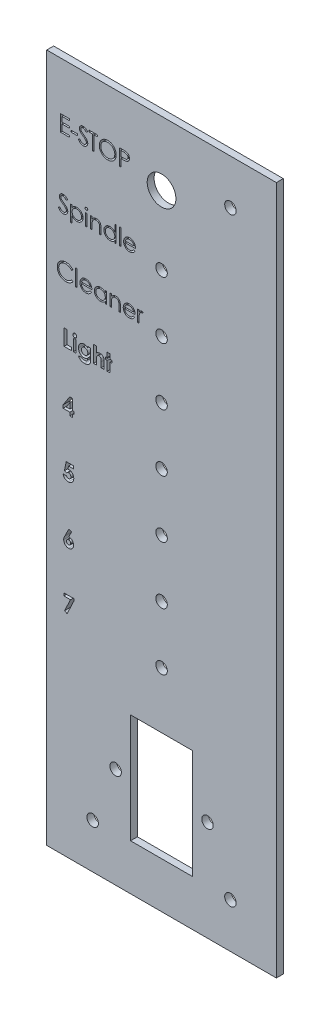
from build123d import *

# Parameters (mm, degrees)
SKETCH1_W           = 100
SKETCH1_H           = 300
BOSS_EXTRUDE1_DEPTH = 3
CUT_EXTRUDE1_REACH  = 160.142
SKETCH2_R           = 2.5
SKETCH2_W           = 27
SKETCH2_H           = 47.5
SKETCH3_R           = 6.25
SKETCH3_R_2         = 2.5
CUT_EXTRUDE2_DEPTH  = 159.142340946
SKETCH4_W           = 2.692307692
SKETCH4_H           = 0.717948718
SKETCH4_W_2         = 0.628205128
SKETCH4_H_2         = 7.179487179
SKETCH4_W_3         = 0.628205129
SKETCH4_H_3         = 5.115384615
SKETCH4_W_4         = 1.256410256
CUT_EXTRUDE3_DEPTH  = 159.142340946
SKETCH5_R           = 2.5
CUT_EXTRUDE4_DEPTH  = 159.142341075


with BuildPart() as part:
    # Sketch1 → Boss-Extrude1 (new body)
    with BuildSketch(Plane.XY):
        Rectangle(SKETCH1_W, SKETCH1_H)
    extrude(amount=BOSS_EXTRUDE1_DEPTH)

    # Sketch2 → Cut-Extrude1 (cut, up to next)
    with BuildSketch(Plane.XY.offset(3), mode=Mode.PRIVATE) as cut_extrude1_sk1:
        with Locations((20, -106.25)):
            Circle(SKETCH2_R)
    cut_extrude1_tool1 = extrude(cut_extrude1_sk1.sketch, amount=-CUT_EXTRUDE1_REACH, mode=Mode.PRIVATE) & part.part
    # Sketch2 → Cut-Extrude1 (cut, up to next)
    with BuildSketch(Plane.XY.offset(3), mode=Mode.PRIVATE) as cut_extrude1_sk2:
        with Locations((-20, -106.25)):
            Circle(SKETCH2_R)
    cut_extrude1_tool2 = extrude(cut_extrude1_sk2.sketch, amount=-CUT_EXTRUDE1_REACH, mode=Mode.PRIVATE) & part.part
    # Sketch2 → Cut-Extrude1 (cut, up to next)
    with BuildSketch(Plane.XY.offset(3), mode=Mode.PRIVATE) as cut_extrude1_sk3:
        with Locations((0, -106.25)):
            Rectangle(SKETCH2_W, SKETCH2_H)
    cut_extrude1_tool3 = extrude(cut_extrude1_sk3.sketch, amount=-CUT_EXTRUDE1_REACH, mode=Mode.PRIVATE) & part.part
    add(cut_extrude1_tool1.solids().sort_by_distance((20, -106.25, 3))[0], mode=Mode.SUBTRACT)
    add(cut_extrude1_tool2.solids().sort_by_distance((-20, -106.25, 3))[0], mode=Mode.SUBTRACT)
    add(cut_extrude1_tool3.solids().sort_by_distance((0, -106.25, 3))[0], mode=Mode.SUBTRACT)

    # Sketch3 → Cut-Extrude2 (cut, through all)
    with BuildSketch(Plane.XY.offset(3)):
        with Locations((0, 122)):
            Circle(SKETCH3_R)
        with Locations((0, 92)):
            Circle(SKETCH3_R_2)
        with Locations((0, 67)):
            Circle(SKETCH3_R_2)
        with Locations((0, 42)):
            Circle(SKETCH3_R_2)
        with Locations((0, 17)):
            Circle(SKETCH3_R_2)
        with Locations((0, -8)):
            Circle(SKETCH3_R_2)
        with Locations((0, -33)):
            Circle(SKETCH3_R_2)
        with Locations((0, -58)):
            Circle(SKETCH3_R_2)
    extrude(amount=-CUT_EXTRUDE2_DEPTH, mode=Mode.SUBTRACT)

    # Sketch4 → Cut-Extrude3 (cut, through all)
    # profile 1 of 31: a face of its own
    with BuildSketch(Plane.XY.offset(3)):
        with BuildLine():
            Line((-18.307692308, 129), (-16.934895833, 129))
            add(Edge.make_bspline(
                [(-16.934895833, 129), (-16.840474021, 128.999896208), (-16.659557635, 128.999697337), (-16.400127524, 128.993667845), (-16.164508061, 128.985614461), (-15.953207299, 128.974450674), (-15.765575103, 128.961257494), (-15.602460504, 128.942753415), (-15.462581391, 128.923432824), (-15.378768492, 128.903790011), (-15.340544872, 128.894831731)],
                knots=[0, 0, 0, 0, 1.415646017, 2.712440637, 3.8905458, 4.950247383, 5.884950622, 6.709939814, 7.411656543, 8, 8, 8, 8], degree=3))
            add(Edge.make_bspline(
                [(-15.340544872, 128.894831731), (-15.292157804, 128.881587831), (-15.19652385, 128.855412108), (-15.058721764, 128.802984661), (-14.927614073, 128.74082033), (-14.802750956, 128.669972451), (-14.68566679, 128.587401322), (-14.574614708, 128.496454087), (-14.470574747, 128.39503095), (-14.374131963, 128.28426947), (-14.285562368, 128.16602905), (-14.209303003, 128.03854459), (-14.145448549, 127.903961984), (-14.090682006, 127.762374841), (-14.051265097, 127.612594194), (-14.021571297, 127.45566077), (-14.002724042, 127.291591389), (-14.000918919, 127.179471654), (-14, 127.122395833)],
                knots=[0, 0, 0, 0, 0.999701418, 1.975846123, 2.934577507, 3.890451536, 4.834027766, 5.787354733, 6.749476667, 7.726910423, 8.712836071, 9.690891519, 10.682875813, 11.679750201, 12.712814741, 13.765529915, 14.8625177, 16, 16, 16, 16], degree=3))
            add(Edge.make_bspline(
                [(-14, 127.122395833), (-14.000842849, 127.06484028), (-14.002491941, 126.952228952), (-14.022284512, 126.787483375), (-14.048944895, 126.630046595), (-14.089939, 126.480267694), (-14.143630346, 126.339036153), (-14.206614452, 126.204193689), (-14.282581513, 126.078034346), (-14.369871172, 125.96010011), (-14.466974361, 125.850280286), (-14.573480237, 125.749370697), (-14.688958822, 125.65796202), (-14.813043118, 125.575849333), (-14.946942816, 125.504936774), (-15.088627123, 125.441422164), (-15.239327556, 125.388080042), (-15.343612584, 125.36001992), (-15.396634615, 125.345753205)],
                knots=[0, 0, 0, 0, 1.121902311, 2.195077645, 3.232258892, 4.234102512, 5.217864754, 6.176164875, 7.132989551, 8.084763148, 9.034132444, 9.988522005, 10.94243251, 11.903244335, 12.886203696, 13.894208494, 14.929344452, 16, 16, 16, 16], degree=3))
            add(Edge.make_bspline(
                [(-15.396634615, 125.345753205), (-15.440489283, 125.336427243), (-15.536599338, 125.315988855), (-15.694884782, 125.293171941), (-15.879175554, 125.27369674), (-16.089220114, 125.259094464), (-16.324829924, 125.246593728), (-16.586132439, 125.23665754), (-16.873640593, 125.231197832), (-17.074183081, 125.230916246), (-17.178886218, 125.230769231)],
                knots=[0, 0, 0, 0, 0.601384939, 1.31797006, 2.144135048, 3.087295005, 4.142315834, 5.309527816, 6.595305764, 8, 8, 8, 8], degree=3))
            Line((-17.178886218, 125.230769231), (-17.679487179, 125.230769231))
            Line((-17.679487179, 125.230769231), (-17.679487179, 122))
            Line((-17.679487179, 122), (-18.307692308, 122))
            Line((-18.307692308, 122), (-18.307692308, 129))
        make_face()
        with BuildLine():
            Line((-17.679487179, 128.282051282), (-17.679487179, 125.948717949))
            Line((-17.679487179, 125.948717949), (-16.453926282, 125.933293269))
            add(Edge.make_bspline(
                [(-16.453926282, 125.933293269), (-16.39408643, 125.933262342), (-16.278566831, 125.933202638), (-16.111694384, 125.941173085), (-15.956875809, 125.95037415), (-15.814586659, 125.963845997), (-15.68476279, 125.982888512), (-15.567187732, 126.002111988), (-15.462773166, 126.029922713), (-15.340574763, 126.067368851), (-15.204408068, 126.131234083), (-15.056272971, 126.223933863), (-14.930731798, 126.342095279), (-14.822095204, 126.474950942), (-14.735883449, 126.622749201), (-14.672771464, 126.780887074), (-14.635689149, 126.947742773), (-14.630716762, 127.061919051), (-14.628205128, 127.119591346)],
                knots=[0, 0, 0, 0, 1.160613943, 2.240541288, 3.23993089, 4.169200891, 5.011653406, 5.7853311, 6.478053781, 7.106038997, 8.262395093, 9.384106736, 10.481365981, 11.59014053, 12.70357646, 13.786202915, 14.881775077, 16, 16, 16, 16], degree=3))
            add(Edge.make_bspline(
                [(-14.628205128, 127.119591346), (-14.630730421, 127.175868373), (-14.635750391, 127.287740137), (-14.673062117, 127.451697659), (-14.735760745, 127.608169067), (-14.822673934, 127.754115238), (-14.928156194, 127.886492846), (-15.05075488, 128.0014871), (-15.190181403, 128.093930506), (-15.319877865, 128.153597069), (-15.435080237, 128.19002762), (-15.535144157, 128.215517301), (-15.648125506, 128.235868513), (-15.774061065, 128.252347519), (-15.911974733, 128.266454441), (-16.063051362, 128.276026396), (-16.226718649, 128.281629308), (-16.340339791, 128.281907219), (-16.399238782, 128.282051282)],
                knots=[0, 0, 0, 0, 1.120700087, 2.227813068, 3.331159281, 4.466773991, 5.599788987, 6.693661531, 7.80175334, 8.91857717, 9.525282508, 10.207424825, 10.974604443, 11.810962634, 12.737642355, 13.736264703, 14.826523623, 16, 16, 16, 16], degree=3))
            Line((-16.399238782, 128.282051282), (-17.679487179, 128.282051282))
        make_face(mode=Mode.SUBTRACT)
    # profile 2 of 31: a face of its own
    with BuildSketch(Plane.XY.offset(3)):
        with BuildLine():
            add(Edge.make_bspline(
                [(-23.467948718, 129.179487179), (-23.338332506, 129.176204221), (-23.083755572, 129.169756219), (-22.709605777, 129.120398012), (-22.352415586, 129.035007232), (-22.009275309, 128.921281267), (-21.684289355, 128.769572496), (-21.37501157, 128.586202199), (-21.082177823, 128.369249282), (-20.80973506, 128.120390828), (-20.560421159, 127.84962392), (-20.340769387, 127.5606681), (-20.156684799, 127.255270496), (-20.005513225, 126.934348834), (-19.886916005, 126.598628898), (-19.805077918, 126.246320893), (-19.752801618, 125.879707513), (-19.746690063, 125.629653783), (-19.743589744, 125.502804487)],
                knots=[0, 0, 0, 0, 1.065120563, 2.091984664, 3.0946048, 4.079830382, 5.057816894, 6.036188127, 7.030412546, 8.04752943, 9.064399622, 10.05169764, 11.02544977, 11.989514704, 12.962713494, 13.945757189, 14.957906945, 16, 16, 16, 16], degree=3))
            add(Edge.make_bspline(
                [(-19.743589744, 125.502804487), (-19.746689609, 125.376889594), (-19.752799802, 125.128696754), (-19.805137357, 124.764409865), (-19.887219357, 124.414228472), (-20.004411889, 124.078737167), (-20.154862846, 123.757582039), (-20.340173188, 123.451608131), (-20.55845561, 123.160715135), (-20.806869312, 122.888089804), (-21.077671396, 122.638094863), (-21.36813193, 122.420257111), (-21.671718569, 122.232808862), (-21.992337986, 122.083241514), (-22.325738059, 121.963697673), (-22.674902706, 121.882192413), (-23.038195814, 121.829618327), (-23.285937821, 121.823581295), (-23.411858974, 121.820512821)],
                knots=[0, 0, 0, 0, 1.043624062, 2.057103931, 3.04512605, 4.022047818, 4.998200453, 5.980619268, 6.982898556, 8.009068085, 9.034988726, 10.034168286, 11.015286542, 11.987931943, 12.962482838, 13.94673481, 14.956375938, 16, 16, 16, 16], degree=3))
            add(Edge.make_bspline(
                [(-23.411858974, 121.820512821), (-23.538707612, 121.823611594), (-23.788760044, 121.829720102), (-24.155834115, 121.882082912), (-24.508389603, 121.963965519), (-24.845418305, 122.080984392), (-25.167108164, 122.232218853), (-25.47408833, 122.416627611), (-25.765126624, 122.635441894), (-26.037810117, 122.883775043), (-26.287308513, 123.154118147), (-26.504827265, 123.443786657), (-26.689277492, 123.74709757), (-26.840004156, 124.064892619), (-26.959333075, 124.395635504), (-27.040742711, 124.741532459), (-27.093414616, 125.100611471), (-27.099484309, 125.345097267), (-27.102564103, 125.469150641)],
                knots=[0, 0, 0, 0, 1.053102029, 2.075944431, 3.073151272, 4.055350789, 5.033113405, 6.020478099, 7.024410459, 8.052272461, 9.079885166, 10.07527673, 11.055994387, 12.023226415, 12.992069828, 13.970394897, 14.97016774, 16, 16, 16, 16], degree=3))
            add(Edge.make_bspline(
                [(-27.102564103, 125.469150641), (-27.101494832, 125.552415979), (-27.099369779, 125.717896226), (-27.073786394, 125.963629427), (-27.036662992, 126.205410742), (-26.983459166, 126.442552638), (-26.913875832, 126.674474607), (-26.831771778, 126.902776133), (-26.731492087, 127.125143581), (-26.618130791, 127.342630364), (-26.491607175, 127.551846176), (-26.351855676, 127.749605342), (-26.203784939, 127.937567336), (-26.041458152, 128.110861343), (-25.870225261, 128.274528656), (-25.687308505, 128.42605409), (-25.493824016, 128.566803992), (-25.288939257, 128.693644674), (-25.077702707, 128.808362943), (-24.859949151, 128.906806645), (-24.638636008, 128.991298768), (-24.412726713, 129.059780419), (-24.182821168, 129.113844491), (-23.948417599, 129.150659198), (-23.709702747, 129.176307834), (-23.548880109, 129.178422838), (-23.467948718, 129.179487179)],
                knots=[0, 0, 0, 0, 1.037015668, 2.060948919, 3.074880161, 4.083647147, 5.086022904, 6.090072063, 7.104153813, 8.122640571, 9.144368836, 10.147691507, 11.138137339, 12.123020368, 13.103399296, 14.087645067, 15.080126199, 16.082011238, 17.087798457, 18.072939717, 19.057185487, 20.037253025, 21.01195951, 21.997135196, 22.992090687, 24, 24, 24, 24], degree=3))
        make_face()
        with BuildLine():
            add(Edge.make_bspline(
                [(-23.437099359, 128.461538462), (-23.503528626, 128.460728681), (-23.635752092, 128.459116862), (-23.832321164, 128.43788543), (-24.026305032, 128.407625652), (-24.217743756, 128.364462611), (-24.405836335, 128.305654505), (-24.592336018, 128.237972689), (-24.775542125, 128.155530508), (-24.954849841, 128.062385099), (-25.128679991, 127.959287257), (-25.292705394, 127.845343723), (-25.447350682, 127.723226615), (-25.592237215, 127.59265094), (-25.72693956, 127.452951737), (-25.854108963, 127.306246864), (-25.968648126, 127.148343082), (-26.07361928, 126.983522269), (-26.16755496, 126.811999106), (-26.25108567, 126.635579382), (-26.319413687, 126.452824008), (-26.37513844, 126.265715693), (-26.421338061, 126.074550774), (-26.45060591, 125.877879076), (-26.472070629, 125.676688852), (-26.473590319, 125.540725144), (-26.474358974, 125.471955128)],
                knots=[0, 0, 0, 0, 1.008559885, 2.007477868, 2.99961109, 3.989939068, 4.984837346, 5.991145699, 7.001802488, 8.033829008, 9.059044045, 10.069351652, 11.065060232, 12.050310815, 13.029377138, 14.011219647, 14.996725999, 15.989392538, 16.977580475, 17.965360261, 18.951710183, 19.937753436, 20.929683414, 21.935841486, 22.955955122, 24, 24, 24, 24], degree=3))
            add(Edge.make_bspline(
                [(-26.474358974, 125.471955128), (-26.47180925, 125.370830687), (-26.466793155, 125.171887626), (-26.422878014, 124.880351338), (-26.355234066, 124.600174766), (-26.255519333, 124.332890947), (-26.130818103, 124.076202381), (-25.976764323, 123.832386172), (-25.794246152, 123.601376423), (-25.586919099, 123.384785885), (-25.360273685, 123.187094277), (-25.119608225, 123.01356746), (-24.86750101, 122.86674696), (-24.603294605, 122.747136815), (-24.328399527, 122.65235734), (-24.041044425, 122.587400077), (-23.743143506, 122.544649167), (-23.540082195, 122.540543655), (-23.437099359, 122.538461538)],
                knots=[0, 0, 0, 0, 1.032063989, 2.030389145, 3.003944642, 3.970395727, 4.937377036, 5.913328081, 6.909231446, 7.93887556, 8.970685674, 9.976071282, 10.964166581, 11.944589148, 12.933237628, 13.927779006, 14.949070134, 16, 16, 16, 16], degree=3))
            add(Edge.make_bspline(
                [(-23.437099359, 122.538461538), (-23.367880356, 122.539412547), (-23.230598283, 122.541298683), (-23.026407238, 122.560296037), (-22.825894815, 122.590759776), (-22.629342255, 122.634621087), (-22.436972632, 122.6895155), (-22.247983026, 122.754730956), (-22.064386445, 122.836093363), (-21.88386677, 122.925989266), (-21.711074286, 123.028469581), (-21.546123222, 123.138545881), (-21.393171262, 123.260483122), (-21.248393119, 123.389118747), (-21.113137741, 123.527046443), (-20.988319773, 123.674086886), (-20.874359509, 123.831168201), (-20.769428215, 123.995739012), (-20.67582169, 124.167731518), (-20.594263492, 124.344790874), (-20.52507126, 124.526481092), (-20.46921425, 124.713064235), (-20.425443327, 124.904185933), (-20.395283487, 125.100102089), (-20.37418661, 125.300420774), (-20.372596456, 125.435908486), (-20.371794872, 125.504206731)],
                knots=[0, 0, 0, 0, 1.047197238, 2.076906641, 3.100256066, 4.114471768, 5.12198147, 6.126382909, 7.136867548, 8.15857795, 9.17633901, 10.174870724, 11.156907918, 12.133735059, 13.104061851, 14.077631395, 15.04955518, 16.038496417, 17.029181396, 18.010275684, 18.986308667, 19.968651475, 20.955262928, 21.950658345, 22.966943676, 24, 24, 24, 24], degree=3))
            add(Edge.make_bspline(
                [(-20.371794872, 125.504206731), (-20.372597098, 125.572037739), (-20.374188461, 125.70659304), (-20.39527341, 125.905514676), (-20.425475191, 126.100021099), (-20.469000607, 126.289348705), (-20.525100914, 126.473545755), (-20.594275575, 126.652439251), (-20.675846174, 126.826695641), (-20.769462623, 126.995884235), (-20.87469427, 127.158233711), (-20.989682756, 127.313438536), (-21.116413453, 127.458584019), (-21.251265502, 127.597253407), (-21.397607273, 127.726489186), (-21.554775861, 127.846334227), (-21.720863217, 127.959680776), (-21.896717688, 128.0619319), (-22.078205595, 128.156360365), (-22.264433511, 128.237262371), (-22.45329171, 128.30600661), (-22.644299935, 128.36464054), (-22.839065892, 128.4074566), (-23.036273549, 128.4379127), (-23.235650066, 128.459109472), (-23.369736506, 128.460726229), (-23.437099359, 128.461538462)],
                knots=[0, 0, 0, 0, 1.02996197, 2.043119294, 3.035359645, 4.018872909, 4.991431989, 5.957985074, 6.929999688, 7.912076566, 8.892894881, 9.867085534, 10.843653904, 11.817741046, 12.803660682, 13.806313499, 14.818574707, 15.856120519, 16.894564902, 17.924820532, 18.937903209, 19.946497019, 20.957711757, 21.963978472, 22.977135795, 24, 24, 24, 24], degree=3))
        make_face(mode=Mode.SUBTRACT)
    # profile 3 of 31: a face of its own
    with BuildSketch(Plane.XY.offset(3)):
        Polygon((-31.5, 128.282051282), (-31.5, 129), (-27.820512821, 129), (-27.820512821, 128.282051282), (-29.346153846, 128.282051282), (-29.346153846, 122), (-29.974358974, 122), (-29.974358974, 128.282051282), align=None)
    # profile 4 of 31: a face of its own
    with BuildSketch(Plane.XY.offset(3)):
        with BuildLine():
            Line((-36.256410256, 123.350360577), (-35.664663462, 123.705128205))
            add(Edge.make_bspline(
                [(-35.664663462, 123.705128205), (-35.609626987, 123.612999435), (-35.504179226, 123.436484267), (-35.328276507, 123.197968187), (-35.146010685, 122.995243873), (-34.956032018, 122.829490658), (-34.759500122, 122.698992884), (-34.555132014, 122.606588421), (-34.343616393, 122.54895647), (-34.19966875, 122.541956297), (-34.127804487, 122.538461538)],
                knots=[0, 0, 0, 0, 1.272034388, 2.437168799, 3.508375237, 4.49857839, 5.41946034, 6.295179144, 7.148887113, 8, 8, 8, 8], degree=3))
            add(Edge.make_bspline(
                [(-34.127804487, 122.538461538), (-34.066430766, 122.540170883), (-33.94475722, 122.543559664), (-33.765632734, 122.576121268), (-33.59166913, 122.626145526), (-33.426451854, 122.697787389), (-33.272260625, 122.78446436), (-33.137047234, 122.889156715), (-33.020155008, 123.006369127), (-32.924536779, 123.137134436), (-32.851176708, 123.277768733), (-32.794792572, 123.422120636), (-32.763502424, 123.572457773), (-32.758788917, 123.673678698), (-32.756410256, 123.724759615)],
                knots=[0, 0, 0, 0, 1.095163259, 2.171163733, 3.241058638, 4.321873601, 5.38011039, 6.391990106, 7.366004449, 8.327778327, 9.272591725, 10.192022065, 11.087607919, 12, 12, 12, 12], degree=3))
            add(Edge.make_bspline(
                [(-32.756410256, 123.724759615), (-32.759358878, 123.783041315), (-32.765352994, 123.901519493), (-32.816015954, 124.076318799), (-32.895714448, 124.249303939), (-32.969239735, 124.35630647), (-33.007411859, 124.411858974)],
                knots=[0, 0, 0, 0, 0.938893495, 1.908633276, 2.914225137, 4, 4, 4, 4], degree=3))
            add(Edge.make_bspline(
                [(-33.007411859, 124.411858974), (-33.038753087, 124.451952622), (-33.104550076, 124.536124219), (-33.217665101, 124.66141469), (-33.35039733, 124.790651528), (-33.49820444, 124.928769641), (-33.666470617, 125.069345235), (-33.849925646, 125.219081791), (-34.053253364, 125.372284945), (-34.195852357, 125.475030076), (-34.26943109, 125.528044872)],
                knots=[0, 0, 0, 0, 0.722233717, 1.516239348, 2.393582979, 3.351407094, 4.387010283, 5.505090956, 6.712668013, 8, 8, 8, 8], degree=3))
            add(Edge.make_bspline(
                [(-34.26943109, 125.528044872), (-34.343079082, 125.580502047), (-34.483888435, 125.680796172), (-34.6808056, 125.82964474), (-34.856894526, 125.965732479), (-35.011372559, 126.090340503), (-35.144171753, 126.203485712), (-35.256338575, 126.304081591), (-35.345015689, 126.394848712), (-35.39432685, 126.453731396), (-35.416466346, 126.480168269)],
                knots=[0, 0, 0, 0, 1.452282411, 2.77665338, 3.964542531, 5.026858415, 5.96415736, 6.766646006, 7.446254459, 8, 8, 8, 8], degree=3))
            add(Edge.make_bspline(
                [(-35.416466346, 126.480168269), (-35.447411437, 126.521370343), (-35.50826911, 126.60239975), (-35.588601121, 126.729049466), (-35.656879447, 126.858695997), (-35.710404111, 126.991687726), (-35.755476549, 127.126157584), (-35.78579241, 127.263860075), (-35.804775204, 127.404177312), (-35.806719177, 127.498604313), (-35.807692308, 127.545873397)],
                knots=[0, 0, 0, 0, 1.068054152, 2.10047183, 3.106115577, 4.101338837, 5.06977816, 6.043150881, 7.020423561, 8, 8, 8, 8], degree=3))
            add(Edge.make_bspline(
                [(-35.807692308, 127.545873397), (-35.80508189, 127.619932947), (-35.79991685, 127.766469074), (-35.756235815, 127.980530735), (-35.687290028, 128.184903569), (-35.590700252, 128.377564237), (-35.466185546, 128.553496199), (-35.322093597, 128.714723173), (-35.150470625, 128.850260337), (-34.962165378, 128.968684454), (-34.756052634, 129.061376304), (-34.540070827, 129.131298264), (-34.313876683, 129.17091678), (-34.160670414, 129.17660231), (-34.082932692, 129.179487179)],
                knots=[0, 0, 0, 0, 1.005424448, 1.989358655, 2.955360095, 3.929531133, 4.905563448, 5.876582895, 6.856512386, 7.866279853, 8.892233794, 9.918561126, 10.94386622, 12, 12, 12, 12], degree=3))
            add(Edge.make_bspline(
                [(-34.082932692, 129.179487179), (-34.000444492, 129.176642076), (-33.836401788, 129.170984074), (-33.595103357, 129.121789011), (-33.362781924, 129.040387668), (-33.175895395, 128.948010352), (-33.029629872, 128.85574752), (-32.918084406, 128.771707872), (-32.805049505, 128.674957655), (-32.689613395, 128.565239163), (-32.573732076, 128.44154566), (-32.455685172, 128.304724283), (-32.335196634, 128.155611171), (-32.257684914, 128.049162169), (-32.217948718, 127.994591346)],
                knots=[0, 0, 0, 0, 1.286793592, 2.559021753, 3.825965368, 5.121522368, 5.803751409, 6.523245864, 7.299691795, 8.125521123, 9.008227632, 9.944561021, 10.946284179, 12, 12, 12, 12], degree=3))
            Line((-32.217948718, 127.994591346), (-32.785857372, 127.564102564))
            add(Edge.make_bspline(
                [(-32.785857372, 127.564102564), (-32.820149237, 127.608279945), (-32.886187351, 127.693355251), (-32.986446325, 127.812497883), (-33.08094362, 127.921330842), (-33.17404442, 128.015861098), (-33.260831683, 128.101265364), (-33.345065767, 128.174384878), (-33.42553447, 128.235936069), (-33.526968291, 128.301623189), (-33.654403728, 128.366736196), (-33.8143728, 128.421834352), (-33.98154535, 128.454944476), (-34.095404613, 128.459322251), (-34.153044872, 128.461538462)],
                knots=[0, 0, 0, 0, 1.181633172, 2.275549214, 3.290209073, 4.226197932, 5.078386478, 5.862611352, 6.581680152, 7.217281963, 8.414376989, 9.595101626, 10.782541182, 12, 12, 12, 12], degree=3))
            add(Edge.make_bspline(
                [(-34.153044872, 128.461538462), (-34.225357917, 128.459115062), (-34.364806811, 128.454441763), (-34.562787284, 128.403401793), (-34.740975134, 128.323038072), (-34.894080264, 128.210408116), (-35.021554218, 128.07696613), (-35.113765136, 127.92340842), (-35.169265465, 127.753843615), (-35.176038024, 127.635560302), (-35.179487179, 127.575320513)],
                knots=[0, 0, 0, 0, 1.14458467, 2.207223713, 3.21896685, 4.227309161, 5.202851033, 6.127160689, 7.046193047, 8, 8, 8, 8], degree=3))
            add(Edge.make_bspline(
                [(-35.179487179, 127.575320513), (-35.178700926, 127.537817556), (-35.177127134, 127.462750317), (-35.155177539, 127.351847473), (-35.126978881, 127.241224794), (-35.082293617, 127.131379628), (-35.02060301, 127.02039091), (-34.939592658, 126.906347435), (-34.837566034, 126.788244018), (-34.759412009, 126.71142927), (-34.718149038, 126.670873397)],
                knots=[0, 0, 0, 0, 0.858281714, 1.717966888, 2.583508476, 3.4729293, 4.427298488, 5.488583878, 6.674047936, 8, 8, 8, 8], degree=3))
            add(Edge.make_bspline(
                [(-34.718149038, 126.670873397), (-34.702826294, 126.657199346), (-34.666422959, 126.624712929), (-34.599871108, 126.571528368), (-34.511985511, 126.505922823), (-34.405061109, 126.42474819), (-34.277126386, 126.330585266), (-34.128167273, 126.224638042), (-33.959844208, 126.103467124), (-33.840400376, 126.018752043), (-33.77724359, 125.973958333)],
                knots=[0, 0, 0, 0, 0.420754252, 0.999615792, 1.744751191, 2.668019286, 3.750313428, 4.999500688, 6.413464383, 8, 8, 8, 8], degree=3))
            add(Edge.make_bspline(
                [(-33.77724359, 125.973958333), (-33.701271763, 125.918675614), (-33.55416285, 125.811628291), (-33.344847691, 125.650796931), (-33.155060074, 125.493501394), (-32.984133667, 125.340746179), (-32.83037985, 125.193689993), (-32.695504409, 125.050563633), (-32.578133048, 124.912392487), (-32.451774611, 124.735247336), (-32.322658972, 124.517685167), (-32.211775957, 124.25112869), (-32.141859263, 123.983536049), (-32.132716232, 123.803682376), (-32.128205128, 123.71494391)],
                knots=[0, 0, 0, 0, 1.163667725, 2.253281268, 3.268753668, 4.215851969, 5.092017293, 5.902905408, 6.650798638, 7.335211899, 8.59617414, 9.77448103, 10.901945474, 12, 12, 12, 12], degree=3))
            add(Edge.make_bspline(
                [(-32.128205128, 123.71494391), (-32.129519404, 123.65218718), (-32.132122435, 123.527892413), (-32.162044262, 123.345382259), (-32.205883592, 123.16812052), (-32.27195806, 122.998298295), (-32.352604377, 122.83280877), (-32.454936873, 122.675992969), (-32.573552242, 122.524380172), (-32.709619772, 122.382013189), (-32.858511577, 122.251320797), (-33.015878966, 122.135062674), (-33.181979512, 122.038126027), (-33.355912145, 121.959024343), (-33.537716819, 121.897157308), (-33.727332386, 121.85233157), (-33.925071409, 121.824820148), (-34.059472372, 121.821964625), (-34.127804487, 121.820512821)],
                knots=[0, 0, 0, 0, 0.983748083, 1.948392443, 2.894712957, 3.844097841, 4.80183111, 5.778335162, 6.776009319, 7.81870978, 8.863265674, 9.881300176, 10.883814829, 11.87499822, 12.874611388, 13.892143829, 14.928324115, 16, 16, 16, 16], degree=3))
            add(Edge.make_bspline(
                [(-34.127804487, 121.820512821), (-34.180675173, 121.821535184), (-34.285750693, 121.823567034), (-34.441169657, 121.841529595), (-34.593448835, 121.866943803), (-34.740677399, 121.907291942), (-34.884752223, 121.956245897), (-35.025046692, 122.016522562), (-35.1616288, 122.088756965), (-35.295263965, 122.171347014), (-35.425612314, 122.267462503), (-35.55145125, 122.379409496), (-35.676909621, 122.504100506), (-35.798284414, 122.644921633), (-35.918030703, 122.799597798), (-36.033787522, 122.969576165), (-36.147950957, 123.153930873), (-36.219581893, 123.283661044), (-36.256410256, 123.350360577)],
                knots=[0, 0, 0, 0, 0.915332311, 1.819136955, 2.706846663, 3.586547465, 4.459518054, 5.340707479, 6.227863349, 7.133153174, 8.059268498, 9.028702269, 10.047606654, 11.120612155, 12.245963614, 13.433783089, 14.680604001, 16, 16, 16, 16], degree=3))
        make_face()
    # profile 5 of 31: a face of its own
    with BuildSketch(Plane.XY.offset(3)):
        with Locations((-38.051282051, 124.692307692)):
            Rectangle(SKETCH4_W, SKETCH4_H)
    # profile 6 of 31: a face of its own
    with BuildSketch(Plane.XY.offset(3)):
        Polygon((-43.974358974, 129), (-40.025641026, 129), (-40.025641026, 128.282051282), (-43.346153846, 128.282051282), (-43.346153846, 126.128205128), (-40.025641026, 126.128205128), (-40.025641026, 125.41025641), (-43.346153846, 125.41025641), (-43.346153846, 122.717948718), (-40.025641026, 122.717948718), (-40.025641026, 122), (-43.974358974, 122), align=None)
    # profile 7 of 31: a face of its own
    with BuildSketch(Plane.XY.offset(3)):
        with BuildLine():
            Line((-12.135016026, 93.615384615), (-11.576923077, 93.322315705))
            add(Edge.make_bspline(
                [(-11.576923077, 93.322315705), (-11.621396267, 93.243429043), (-11.707923484, 93.089946837), (-11.85672498, 92.879083116), (-12.012709125, 92.689387684), (-12.182917061, 92.525928376), (-12.362256419, 92.383425606), (-12.551721729, 92.258749956), (-12.752299364, 92.152512916), (-12.963998814, 92.06300786), (-13.188597916, 91.994188872), (-13.426640949, 91.94558043), (-13.67858394, 91.915533893), (-13.851276299, 91.912043611), (-13.939703526, 91.91025641)],
                knots=[0, 0, 0, 0, 1.120438281, 2.179929193, 3.190490725, 4.156257408, 5.095198341, 6.022838206, 6.959905092, 7.901321166, 8.864066838, 9.862729781, 10.905609505, 12, 12, 12, 12], degree=3))
            add(Edge.make_bspline(
                [(-13.939703526, 91.91025641), (-14.037987481, 91.912550761), (-14.229711004, 91.917026374), (-14.508790498, 91.955611303), (-14.771549335, 92.018556021), (-15.017972742, 92.106487104), (-15.247457247, 92.221341752), (-15.460458957, 92.361260715), (-15.658098008, 92.525525225), (-15.834146427, 92.715558112), (-15.992634192, 92.918922026), (-16.132485832, 93.130833795), (-16.249400694, 93.350760244), (-16.344505915, 93.577301292), (-16.421315644, 93.809029079), (-16.474849052, 94.048052015), (-16.505708548, 94.293723183), (-16.510437439, 94.459917854), (-16.512820513, 94.543669872)],
                knots=[0, 0, 0, 0, 1.145258523, 2.234067595, 3.276747158, 4.290159414, 5.277019952, 6.260822364, 7.254936242, 8.264827045, 9.274100331, 10.257902744, 11.220704747, 12.172965371, 13.118907548, 14.062713208, 15.023725156, 16, 16, 16, 16], degree=3))
            add(Edge.make_bspline(
                [(-16.512820513, 94.543669872), (-16.51070223, 94.622259533), (-16.506504074, 94.778013862), (-16.480042499, 95.008544951), (-16.433145913, 95.232601856), (-16.368793265, 95.450370752), (-16.285690772, 95.66148702), (-16.184026334, 95.866079147), (-16.063641578, 96.063929427), (-15.970696231, 96.188735694), (-15.923878205, 96.251602564)],
                knots=[0, 0, 0, 0, 1.024358464, 2.0301432, 3.019427413, 4.004406732, 4.986367066, 5.972626655, 6.978780325, 8, 8, 8, 8], degree=3))
            add(Edge.make_bspline(
                [(-15.923878205, 96.251602564), (-15.86046284, 96.327340304), (-15.735640946, 96.476416605), (-15.524528236, 96.672293257), (-15.295927843, 96.836380807), (-15.052704591, 96.972395079), (-14.792031643, 97.075742373), (-14.517413061, 97.152757538), (-14.225721888, 97.19591356), (-14.026311446, 97.202009227), (-13.924278846, 97.205128205)],
                knots=[0, 0, 0, 0, 1.030682036, 2.02871468, 2.997146059, 3.962720338, 4.930598197, 5.918074684, 6.934738563, 8, 8, 8, 8], degree=3))
            add(Edge.make_bspline(
                [(-13.924278846, 97.205128205), (-13.819383636, 97.202420107), (-13.613603144, 97.197107437), (-13.313538902, 97.14785477), (-13.029617469, 97.069749661), (-12.76195246, 96.95944208), (-12.510516738, 96.817122976), (-12.276944639, 96.640839293), (-12.057241614, 96.436003119), (-11.929424456, 96.2784767), (-11.864383013, 96.198317308)],
                knots=[0, 0, 0, 0, 1.056321875, 2.072262726, 3.055038591, 4.01806755, 4.982017516, 5.957941055, 6.960871419, 8, 8, 8, 8], degree=3))
            add(Edge.make_bspline(
                [(-11.864383013, 96.198317308), (-11.820129136, 96.137910145), (-11.73191595, 96.017497908), (-11.62142175, 95.821155593), (-11.52550696, 95.615734405), (-11.448841038, 95.39791381), (-11.386762036, 95.17027465), (-11.341848398, 94.931189561), (-11.315509161, 94.680729738), (-11.310331766, 94.510076627), (-11.307692308, 94.423076923)],
                knots=[0, 0, 0, 0, 0.94817472, 1.890038105, 2.849395472, 3.817997239, 4.812318967, 5.836947057, 6.897266129, 8, 8, 8, 8], degree=3))
            Line((-11.307692308, 94.423076923), (-15.884615385, 94.423076923))
            add(Edge.make_bspline(
                [(-15.884615385, 94.423076923), (-15.881536172, 94.355675995), (-15.875481024, 94.223134787), (-15.847250738, 94.029193221), (-15.80275319, 93.844446537), (-15.740215065, 93.670280453), (-15.664481374, 93.504420198), (-15.571709941, 93.348096124), (-15.461030833, 93.202020264), (-15.337579434, 93.064885988), (-15.200165243, 92.942764466), (-15.055599749, 92.833460914), (-14.901812619, 92.74184972), (-14.740016452, 92.667489941), (-14.570472882, 92.609277309), (-14.393128491, 92.569541667), (-14.208332259, 92.542927453), (-14.082360791, 92.539968123), (-14.018229167, 92.538461538)],
                knots=[0, 0, 0, 0, 1.094153842, 2.151609401, 3.174256925, 4.172055639, 5.149267565, 6.128595816, 7.11444997, 8.118368179, 9.117203808, 10.09244225, 11.054858984, 12.015122123, 12.976791628, 13.957293641, 14.960065497, 16, 16, 16, 16], degree=3))
            add(Edge.make_bspline(
                [(-14.018229167, 92.538461538), (-13.955526871, 92.539677652), (-13.83111349, 92.542090654), (-13.645831775, 92.565554476), (-13.46355272, 92.603495027), (-13.285030754, 92.655275007), (-13.113889062, 92.718428711), (-12.955397962, 92.794634427), (-12.80963753, 92.87893392), (-12.673403597, 92.97535327), (-12.54126161, 93.093369644), (-12.410176638, 93.240641086), (-12.269623331, 93.414816142), (-12.181644145, 93.545907474), (-12.135016026, 93.615384615)],
                knots=[0, 0, 0, 0, 0.99110716, 1.966546729, 2.947904876, 3.932708344, 4.903319531, 5.828989031, 6.710028674, 7.56322171, 8.463672341, 9.504779593, 10.677557249, 12, 12, 12, 12], degree=3))
        make_face()
        with BuildLine():
            add(Edge.make_bspline(
                [(-11.935897436, 95.051282051), (-11.958890685, 95.134607799), (-12.003145288, 95.29498304), (-12.095618017, 95.517064821), (-12.199761098, 95.714440623), (-12.323004561, 95.885599889), (-12.462642012, 96.037606915), (-12.623932378, 96.170444085), (-12.804804165, 96.289278987), (-13.004322446, 96.389583986), (-13.215606016, 96.474963704), (-13.4368184, 96.532213935), (-13.662533976, 96.57143302), (-13.815202548, 96.575085237), (-13.892027244, 96.576923077)],
                knots=[0, 0, 0, 0, 1.154881502, 2.222775134, 3.210006277, 4.132804581, 5.035138423, 5.962687519, 6.919655026, 7.923214229, 8.944639381, 9.960483929, 10.97369054, 12, 12, 12, 12], degree=3))
            add(Edge.make_bspline(
                [(-13.892027244, 96.576923077), (-13.954726121, 96.575699734), (-14.078668619, 96.573281442), (-14.261270755, 96.550341183), (-14.436630153, 96.512421493), (-14.606040728, 96.46049158), (-14.767282465, 96.391274375), (-14.923672001, 96.310107922), (-15.071232794, 96.211024754), (-15.163515385, 96.135507045), (-15.210136218, 96.097355769)],
                knots=[0, 0, 0, 0, 1.04873581, 2.073130211, 3.073294108, 4.04793562, 5.032784715, 6.005352987, 6.992311501, 8, 8, 8, 8], degree=3))
            add(Edge.make_bspline(
                [(-15.210136218, 96.097355769), (-15.243522782, 96.067167138), (-15.31108905, 96.006072706), (-15.401370093, 95.900814293), (-15.487811039, 95.787311168), (-15.566478344, 95.661220919), (-15.638633517, 95.523979361), (-15.706153471, 95.376744091), (-15.766926296, 95.21839783), (-15.801118516, 95.108052952), (-15.818709936, 95.051282051)],
                knots=[0, 0, 0, 0, 0.879870761, 1.780643979, 2.707998968, 3.669668524, 4.684282772, 5.740141944, 6.837334558, 8, 8, 8, 8], degree=3))
            Line((-15.818709936, 95.051282051), (-11.935897436, 95.051282051))
        make_face(mode=Mode.SUBTRACT)
    # profile 8 of 31: a face of its own
    with BuildSketch(Plane.XY.offset(3)):
        with Locations((-18.083333333, 95.58974359)):
            Rectangle(SKETCH4_W_2, SKETCH4_H_2)
    # profile 9 of 31: a face of its own
    with BuildSketch(Plane.XY.offset(3)):
        with BuildLine():
            Line((-19.743589744, 99.179487179), (-19.743589744, 92))
            Line((-19.743589744, 92), (-20.371794872, 92))
            Line((-20.371794872, 92), (-20.371794872, 92.884815705))
            add(Edge.make_bspline(
                [(-20.371794872, 92.884815705), (-20.442632453, 92.804736517), (-20.580872884, 92.648460975), (-20.81175512, 92.44429663), (-21.056491475, 92.275539987), (-21.313894118, 92.139240156), (-21.583730604, 92.036856043), (-21.865402779, 91.964083725), (-22.159025541, 91.917296054), (-22.35953025, 91.912624011), (-22.461137821, 91.91025641)],
                knots=[0, 0, 0, 0, 1.074387032, 2.096679803, 3.090159297, 4.057316773, 5.018401886, 5.985159533, 6.978961417, 8, 8, 8, 8], degree=3))
            add(Edge.make_bspline(
                [(-22.461137821, 91.91025641), (-22.551473728, 91.912709155), (-22.729620138, 91.917546076), (-22.991678292, 91.955070683), (-23.243862791, 92.015331926), (-23.486411936, 92.099133705), (-23.717756227, 92.210295348), (-23.939876421, 92.343377844), (-24.151621805, 92.501859505), (-24.349764883, 92.683035561), (-24.532228883, 92.879825536), (-24.692351429, 93.089716629), (-24.825857588, 93.311801237), (-24.93749775, 93.543267545), (-25.023490439, 93.785897384), (-25.083437707, 94.03885172), (-25.120918601, 94.301831467), (-25.125753522, 94.480910513), (-25.128205128, 94.571714744)],
                knots=[0, 0, 0, 0, 1.033919861, 2.038935746, 3.024066025, 3.998881131, 4.97069526, 5.957263378, 6.95902576, 7.993208707, 9.027059324, 10.027763471, 11.009749337, 11.988697705, 12.965288445, 13.950418724, 14.960734635, 16, 16, 16, 16], degree=3))
            add(Edge.make_bspline(
                [(-25.128205128, 94.571714744), (-25.125699185, 94.660642151), (-25.120745072, 94.836446837), (-25.083838632, 95.095004233), (-25.021776615, 95.344040755), (-24.934680919, 95.582754641), (-24.82299701, 95.811434742), (-24.687140835, 96.030242792), (-24.527102586, 96.239781587), (-24.342597772, 96.43512404), (-24.142728232, 96.615565269), (-23.92891077, 96.77238336), (-23.706464207, 96.907817057), (-23.471938186, 97.01512401), (-23.228803977, 97.101942219), (-22.974897085, 97.162008155), (-22.711273928, 97.197402798), (-22.532292944, 97.202528326), (-22.44150641, 97.205128205)],
                knots=[0, 0, 0, 0, 1.020392517, 2.01726096, 2.990465484, 3.961182959, 4.928053699, 5.906110375, 6.912531644, 7.948652711, 8.985773172, 9.998621852, 10.987621588, 11.969261332, 12.953316658, 13.946091881, 14.958173133, 16, 16, 16, 16], degree=3))
            add(Edge.make_bspline(
                [(-22.44150641, 97.205128205), (-22.337072795, 97.201994013), (-22.132081213, 97.195841942), (-21.83228417, 97.144429208), (-21.548708949, 97.058103453), (-21.279722974, 96.93992089), (-21.026929854, 96.786319388), (-20.788476573, 96.600816492), (-20.568509927, 96.3781622), (-20.438366282, 96.210939053), (-20.371794872, 96.125400641)],
                knots=[0, 0, 0, 0, 1.031072012, 2.023879775, 2.993683497, 3.952812103, 4.918022106, 5.908088563, 6.929940113, 8, 8, 8, 8], degree=3))
            Line((-20.371794872, 96.125400641), (-20.371794872, 99.179487179))
            Line((-20.371794872, 99.179487179), (-19.743589744, 99.179487179))
        make_face()
        with BuildLine():
            add(Edge.make_bspline(
                [(-22.433092949, 96.576923077), (-22.524921624, 96.573655801), (-22.706176824, 96.567206719), (-22.972264829, 96.516859729), (-23.226891657, 96.43309054), (-23.468783805, 96.318526738), (-23.694120238, 96.174469265), (-23.89550758, 96.000226498), (-24.074592983, 95.80055247), (-24.225209511, 95.576348249), (-24.347990505, 95.335992067), (-24.434324569, 95.084743191), (-24.491263064, 94.827133236), (-24.497080105, 94.652407864), (-24.5, 94.564703526)],
                knots=[0, 0, 0, 0, 1.031046209, 2.035121221, 3.029706178, 4.034933723, 5.034054252, 6.02443088, 7.017295772, 8.038157696, 9.050218397, 10.03989886, 11.016116709, 12, 12, 12, 12], degree=3))
            add(Edge.make_bspline(
                [(-24.5, 94.564703526), (-24.496270213, 94.477523311), (-24.48882526, 94.3035046), (-24.435323871, 94.045543446), (-24.345564124, 93.794235362), (-24.223079999, 93.551713375), (-24.069706749, 93.326545174), (-23.891929444, 93.123064929), (-23.688028881, 92.948085752), (-23.462173867, 92.801610605), (-23.220957926, 92.683285563), (-22.967290063, 92.600954284), (-22.705938787, 92.547798723), (-22.528234119, 92.54158977), (-22.438701923, 92.538461538)],
                knots=[0, 0, 0, 0, 0.979072187, 1.954306742, 2.945804271, 3.96968567, 4.997920485, 5.998718438, 6.996577872, 8.005894225, 9.015743152, 10.005417472, 10.995077863, 12, 12, 12, 12], degree=3))
            add(Edge.make_bspline(
                [(-22.438701923, 92.538461538), (-22.347808918, 92.541781466), (-22.167031745, 92.548384474), (-21.900154329, 92.598947004), (-21.641164403, 92.682484601), (-21.393589946, 92.798282854), (-21.162957684, 92.941797566), (-20.955961929, 93.109811748), (-20.780929992, 93.305218116), (-20.632544773, 93.519971022), (-20.51619394, 93.755395015), (-20.431441821, 94.006063397), (-20.38133401, 94.271984893), (-20.37501855, 94.453712747), (-20.371794872, 94.546474359)],
                knots=[0, 0, 0, 0, 1.01762866, 2.023962475, 3.030623092, 4.058876274, 5.077231937, 6.066672613, 7.034107872, 8.005628644, 8.981990164, 9.965428785, 10.961468474, 12, 12, 12, 12], degree=3))
            add(Edge.make_bspline(
                [(-20.371794872, 94.546474359), (-20.373714185, 94.61715002), (-20.377491999, 94.756262087), (-20.406353138, 94.960517122), (-20.452262991, 95.155984574), (-20.516955331, 95.342869952), (-20.6019379, 95.520139983), (-20.704433432, 95.689067503), (-20.826244331, 95.848773926), (-20.965409724, 95.997060068), (-21.117740129, 96.132312992), (-21.27892921, 96.253041474), (-21.450886704, 96.352219019), (-21.630720778, 96.434301562), (-21.818743447, 96.499619862), (-22.016484686, 96.54319525), (-22.22184266, 96.573115892), (-22.361934771, 96.575640653), (-22.433092949, 96.576923077)],
                knots=[0, 0, 0, 0, 1.050140795, 2.067009409, 3.05949893, 4.030605086, 5.00011959, 5.97591094, 6.962425594, 7.979863591, 8.993523472, 9.986985069, 10.967611495, 11.937549037, 12.921786183, 13.919465291, 14.943216303, 16, 16, 16, 16], degree=3))
        make_face(mode=Mode.SUBTRACT)
    # profile 10 of 31: a face of its own
    with BuildSketch(Plane.XY.offset(3)):
        with BuildLine():
            Line((-30.871794872, 97.115384615), (-30.243589744, 97.115384615))
            Line((-30.243589744, 97.115384615), (-30.243589744, 96.192708333))
            add(Edge.make_bspline(
                [(-30.243589744, 96.192708333), (-30.176514473, 96.276393779), (-30.046352571, 96.438788306), (-29.829583905, 96.652229455), (-29.600496104, 96.828119905), (-29.360492097, 96.968327493), (-29.109246077, 97.074020745), (-28.848289537, 97.150352608), (-28.576060125, 97.196122265), (-28.390931251, 97.202102725), (-28.297275641, 97.205128205)],
                knots=[0, 0, 0, 0, 1.12780773, 2.188550248, 3.19190651, 4.159438251, 5.104880172, 6.052711206, 7.014878035, 8, 8, 8, 8], degree=3))
            add(Edge.make_bspline(
                [(-28.297275641, 97.205128205), (-28.202614373, 97.201637814), (-28.017339437, 97.194806277), (-27.747583315, 97.140772895), (-27.495636527, 97.048482385), (-27.262397416, 96.922058244), (-27.052142989, 96.764845297), (-26.867493286, 96.581689734), (-26.714766791, 96.371017567), (-26.612372065, 96.175571255), (-26.54492077, 96.002193666), (-26.502456095, 95.853700166), (-26.466394132, 95.688263864), (-26.435130636, 95.506384686), (-26.413976412, 95.306788305), (-26.397291829, 95.090292921), (-26.38533444, 94.85696866), (-26.384860026, 94.695595405), (-26.384615385, 94.612379808)],
                knots=[0, 0, 0, 0, 1.235846778, 2.418850247, 3.575807741, 4.728682307, 5.871620074, 6.994088408, 8.11269785, 9.256955736, 9.865816715, 10.540099792, 11.271859618, 12.076849838, 12.949306005, 13.892391288, 14.913166135, 16, 16, 16, 16], degree=3))
            Line((-26.384615385, 94.612379808), (-26.384615385, 92))
            Line((-26.384615385, 92), (-27.012820513, 92))
            Line((-27.012820513, 92), (-27.012820513, 94.40625))
            add(Edge.make_bspline(
                [(-27.012820513, 94.40625), (-27.013206929, 94.47589489), (-27.013946077, 94.609113711), (-27.01627737, 94.799851758), (-27.021896984, 94.972824915), (-27.029793609, 95.127619649), (-27.04135167, 95.264087323), (-27.053396933, 95.382505876), (-27.068126887, 95.482724961), (-27.081252713, 95.543055126), (-27.087139423, 95.570112179)],
                knots=[0, 0, 0, 0, 1.430800155, 2.736877192, 3.918605307, 4.986035426, 5.920637409, 6.731861385, 7.431261377, 8, 8, 8, 8], degree=3))
            add(Edge.make_bspline(
                [(-27.087139423, 95.570112179), (-27.108390486, 95.649534549), (-27.149292207, 95.802398039), (-27.250360174, 96.009746744), (-27.377988535, 96.18614312), (-27.533784234, 96.330496563), (-27.716242385, 96.442838236), (-27.924856671, 96.520786146), (-28.157613952, 96.569538684), (-28.321322718, 96.574392948), (-28.406650641, 96.576923077)],
                knots=[0, 0, 0, 0, 1.084156227, 2.086665306, 3.027808233, 3.945421172, 4.874247719, 5.839848303, 6.874090471, 8, 8, 8, 8], degree=3))
            add(Edge.make_bspline(
                [(-28.406650641, 96.576923077), (-28.457186008, 96.575971068), (-28.557194194, 96.574087066), (-28.705494138, 96.55518447), (-28.849342484, 96.524267558), (-28.990182902, 96.482530283), (-29.12519849, 96.425205745), (-29.258727072, 96.360147005), (-29.3857406, 96.279050581), (-29.508947395, 96.188669338), (-29.62357301, 96.088510923), (-29.730229687, 95.982821903), (-29.825305727, 95.870270695), (-29.911443078, 95.7526708), (-29.985799605, 95.628407124), (-30.050705781, 95.498678511), (-30.10577717, 95.363314214), (-30.133142555, 95.269364091), (-30.146834936, 95.222355769)],
                knots=[0, 0, 0, 0, 1.023777757, 2.026029729, 3.023749952, 4.003683103, 4.997618607, 5.993177895, 7.010360494, 8.046726602, 9.087585522, 10.09234134, 11.086953743, 12.070360549, 13.043493632, 14.017870808, 15.008233677, 16, 16, 16, 16], degree=3))
            add(Edge.make_bspline(
                [(-30.146834936, 95.222355769), (-30.154714233, 95.187845363), (-30.171867051, 95.112718014), (-30.19039341, 94.989429176), (-30.207208561, 94.846809226), (-30.221282479, 94.685024591), (-30.229893311, 94.503508841), (-30.239282105, 94.303037166), (-30.242700227, 94.082810189), (-30.243284935, 93.929486803), (-30.243589744, 93.849559295)],
                knots=[0, 0, 0, 0, 0.615963638, 1.340920617, 2.168419149, 3.115676021, 4.16674242, 5.331190069, 6.6087489, 8, 8, 8, 8], degree=3))
            Line((-30.243589744, 93.849559295), (-30.243589744, 92))
            Line((-30.243589744, 92), (-30.871794872, 92))
            Line((-30.871794872, 92), (-30.871794872, 97.115384615))
        make_face()
    # profile 11 of 31: a face of its own
    with BuildSketch(Plane.XY.offset(3)):
        with BuildLine():
            add(Edge.make_bspline(
                [(-32.714342949, 99.269230769), (-32.675360317, 99.267422464), (-32.599024837, 99.263881456), (-32.488638302, 99.233558502), (-32.388124278, 99.182159131), (-32.298968812, 99.11319977), (-32.222465039, 99.032100883), (-32.168903618, 98.937578946), (-32.134478826, 98.835461668), (-32.130321715, 98.76423149), (-32.128205128, 98.727964744)],
                knots=[0, 0, 0, 0, 1.055194115, 2.066272739, 3.074728998, 4.095836921, 5.109056067, 6.073838105, 7.019297344, 8, 8, 8, 8], degree=3))
            add(Edge.make_bspline(
                [(-32.128205128, 98.727964744), (-32.130369448, 98.692639437), (-32.134648052, 98.622805487), (-32.168877028, 98.522458543), (-32.222921504, 98.429249976), (-32.298919755, 98.348308556), (-32.388137277, 98.279387316), (-32.488634849, 98.227977838), (-32.599025746, 98.197657563), (-32.675360624, 98.194116186), (-32.714342949, 98.192307692)],
                knots=[0, 0, 0, 0, 0.96129708, 1.900370562, 2.859976407, 3.87933698, 4.906634145, 5.921202961, 6.938410037, 8, 8, 8, 8], degree=3))
            add(Edge.make_bspline(
                [(-32.714342949, 98.192307692), (-32.752879499, 98.194047133), (-32.827885859, 98.197432726), (-32.936619544, 98.228572762), (-33.036276523, 98.279404908), (-33.125605868, 98.347857278), (-33.200066254, 98.429747073), (-33.254262905, 98.52240166), (-33.288412829, 98.62281997), (-33.292702086, 98.692644302), (-33.294871795, 98.727964744)],
                knots=[0, 0, 0, 0, 1.054934014, 2.053291228, 3.073705704, 4.106921865, 5.123545215, 6.088680038, 7.033164197, 8, 8, 8, 8], degree=3))
            add(Edge.make_bspline(
                [(-33.294871795, 98.727964744), (-33.292749622, 98.764226443), (-33.28858154, 98.835446708), (-33.254237307, 98.937636774), (-33.200517692, 99.031599777), (-33.125556565, 99.113650776), (-33.036289644, 99.182141646), (-32.936616154, 99.232963609), (-32.827886755, 99.264106288), (-32.752879803, 99.267491516), (-32.714342949, 99.269230769)],
                knots=[0, 0, 0, 0, 0.98631895, 1.937192651, 2.907499808, 3.917963147, 4.944918757, 5.95915025, 6.951458133, 8, 8, 8, 8], degree=3))
        make_face()
    # profile 12 of 31: a face of its own
    with BuildSketch(Plane.XY.offset(3)):
        with Locations((-32.711538461, 94.557692308)):
            Rectangle(SKETCH4_W_3, SKETCH4_H_3)
    # profile 13 of 31: a face of its own
    with BuildSketch(Plane.XY.offset(3)):
        with BuildLine():
            Line((-39.576923077, 97.115384615), (-38.948717949, 97.115384615))
            Line((-38.948717949, 97.115384615), (-38.948717949, 96.168870192))
            add(Edge.make_bspline(
                [(-38.948717949, 96.168870192), (-38.882002981, 96.25474566), (-38.752355791, 96.421627446), (-38.528905981, 96.637607703), (-38.293052364, 96.81975831), (-38.038725539, 96.962523376), (-37.769878159, 97.070165), (-37.487613524, 97.1497239), (-37.189535994, 97.196606849), (-36.985743089, 97.202250171), (-36.881810897, 97.205128205)],
                knots=[0, 0, 0, 0, 1.0828784, 2.104357462, 3.088488658, 4.04616522, 5.001424249, 5.969181776, 6.964304535, 8, 8, 8, 8], degree=3))
            add(Edge.make_bspline(
                [(-36.881810897, 97.205128205), (-36.791027691, 97.202501847), (-36.611589914, 97.197310713), (-36.347463457, 97.162164604), (-36.09311269, 97.101929219), (-35.849976582, 97.015127388), (-35.615450451, 96.907816449), (-35.393006252, 96.772382377), (-35.17917914, 96.615569996), (-34.979346762, 96.435105694), (-34.794704027, 96.239849161), (-34.635011665, 96.029804553), (-34.497267856, 95.81187938), (-34.385927263, 95.582695196), (-34.298710568, 95.344056736), (-34.236681213, 95.094999854), (-34.199765926, 94.836447974), (-34.194813023, 94.660642532), (-34.192307692, 94.571714744)],
                knots=[0, 0, 0, 0, 1.041296284, 2.058176809, 3.050446431, 4.034000596, 5.01514041, 6.003636468, 7.015969324, 8.052561599, 9.08815499, 10.094063707, 11.074456064, 12.040834395, 13.011057502, 13.983766392, 14.980127149, 16, 16, 16, 16], degree=3))
            add(Edge.make_bspline(
                [(-34.192307692, 94.571714744), (-34.194758663, 94.480910126), (-34.199592332, 94.301830318), (-34.237082344, 94.038856123), (-34.296996092, 93.785881375), (-34.383112459, 93.543326848), (-34.494395435, 93.311359546), (-34.629804556, 93.090146754), (-34.78957749, 92.879759347), (-34.972179746, 92.683053547), (-35.170285618, 92.501854921), (-35.382040597, 92.343378782), (-35.604158448, 92.210296031), (-35.835502782, 92.099130112), (-36.078054059, 92.015345744), (-36.330680615, 91.954910143), (-36.593244908, 91.917641151), (-36.771847211, 91.912736867), (-36.862179487, 91.91025641)],
                knots=[0, 0, 0, 0, 1.038740735, 2.04854663, 3.033179607, 4.009277356, 4.987731542, 5.972001279, 6.972200261, 8.005528982, 9.039189865, 10.040446548, 11.026516639, 11.997840187, 12.972163198, 13.956796175, 14.96660207, 16, 16, 16, 16], degree=3))
            add(Edge.make_bspline(
                [(-36.862179487, 91.91025641), (-36.963834631, 91.912846026), (-37.164633343, 91.917961275), (-37.458228684, 91.969800095), (-37.740782388, 92.047273967), (-38.009164037, 92.160671954), (-38.265499662, 92.305182986), (-38.508339274, 92.481403398), (-38.73897278, 92.688964647), (-38.877790294, 92.84642828), (-38.948717949, 92.926883013)],
                knots=[0, 0, 0, 0, 1.014726462, 2.004382257, 2.969841629, 3.936926163, 4.907207904, 5.903978561, 6.929055279, 8, 8, 8, 8], degree=3))
            Line((-38.948717949, 92.926883013), (-38.948717949, 90.115384615))
            Line((-38.948717949, 90.115384615), (-39.576923077, 90.115384615))
            Line((-39.576923077, 90.115384615), (-39.576923077, 97.115384615))
        make_face()
        with BuildLine():
            add(Edge.make_bspline(
                [(-36.887419872, 96.576923077), (-36.958578997, 96.575642561), (-37.098672972, 96.573121554), (-37.30401741, 96.543173656), (-37.501808266, 96.499698174), (-37.690052169, 96.433874373), (-37.870553402, 96.353076747), (-38.041921731, 96.252112725), (-38.204036866, 96.132808713), (-38.356490927, 95.997450025), (-38.494217514, 95.848300649), (-38.61614337, 95.689125031), (-38.71855798, 95.520124751), (-38.803562021, 95.342874026), (-38.868248586, 95.155983456), (-38.914160025, 94.960517431), (-38.943020731, 94.756262006), (-38.946798606, 94.617149993), (-38.948717949, 94.546474359)],
                knots=[0, 0, 0, 0, 1.05670511, 2.080379991, 3.077984906, 4.06214886, 5.038337365, 6.01289324, 7.01187578, 8.025460281, 9.038092164, 10.024533457, 11.000252242, 11.969694649, 12.940728589, 13.933144304, 14.949937299, 16, 16, 16, 16], degree=3))
            add(Edge.make_bspline(
                [(-38.948717949, 94.546474359), (-38.945536237, 94.453698134), (-38.939302993, 94.271941652), (-38.888628257, 94.006373408), (-38.806157729, 93.755070097), (-38.689100301, 93.520148023), (-38.541205153, 93.304182352), (-38.36300884, 93.110801139), (-38.156123738, 92.941219957), (-37.923989355, 92.79837745), (-37.675145093, 92.682401317), (-37.415573269, 92.599372896), (-37.148843508, 92.54822844), (-36.968506868, 92.541734801), (-36.877604167, 92.538461538)],
                knots=[0, 0, 0, 0, 1.03728447, 2.032128127, 3.01272805, 3.987917167, 4.958271349, 5.931593992, 6.91984656, 7.941419022, 8.973179163, 9.983609215, 10.983593296, 12, 12, 12, 12], degree=3))
            add(Edge.make_bspline(
                [(-36.877604167, 92.538461538), (-36.788532631, 92.541574292), (-36.611741645, 92.547752549), (-36.351425402, 92.601228924), (-36.098444125, 92.682918973), (-35.85808378, 92.802038086), (-35.632436805, 92.948018202), (-35.428673697, 93.123138268), (-35.25065987, 93.326118155), (-35.09893116, 93.552135161), (-34.97666819, 93.794485928), (-34.88480771, 94.045248705), (-34.831790563, 94.303539551), (-34.824276986, 94.477534977), (-34.820512821, 94.564703526)],
                knots=[0, 0, 0, 0, 1.00104056, 1.986885549, 2.97790532, 3.984399681, 4.995088187, 5.994304198, 6.996462723, 8.023150851, 9.048424203, 10.043036403, 11.019596776, 12, 12, 12, 12], degree=3))
            add(Edge.make_bspline(
                [(-34.820512821, 94.564703526), (-34.823422288, 94.652413504), (-34.829218556, 94.827150111), (-34.886312631, 95.084675917), (-34.972112587, 95.336451869), (-35.097230691, 95.575492969), (-35.245633229, 95.801041134), (-35.425127223, 96.000148892), (-35.626359616, 96.174490238), (-35.851737944, 96.318521057), (-36.093618795, 96.433092047), (-36.348248627, 96.516859325), (-36.614335832, 96.567206824), (-36.795591141, 96.573655837), (-36.887419872, 96.576923077)],
                knots=[0, 0, 0, 0, 0.983928682, 1.960191568, 2.949917689, 3.96440592, 4.982380491, 5.975291189, 6.965713506, 7.964880129, 8.970154049, 9.96478489, 10.968906225, 12, 12, 12, 12], degree=3))
        make_face(mode=Mode.SUBTRACT)
    # profile 14 of 31: a face of its own
    with BuildSketch(Plane.XY.offset(3)):
        with BuildLine():
            Line((-44.961538462, 93.350360577), (-44.369791667, 93.705128205))
            add(Edge.make_bspline(
                [(-44.369791667, 93.705128205), (-44.314755192, 93.612999435), (-44.209307431, 93.436484267), (-44.033404713, 93.197968187), (-43.85113889, 92.995243873), (-43.661160223, 92.829490658), (-43.464628327, 92.698992884), (-43.260260219, 92.606588421), (-43.048744598, 92.54895647), (-42.904796955, 92.541956297), (-42.832932692, 92.538461538)],
                knots=[0, 0, 0, 0, 1.272034388, 2.437168799, 3.508375237, 4.49857839, 5.41946034, 6.295179144, 7.148887113, 8, 8, 8, 8], degree=3))
            add(Edge.make_bspline(
                [(-42.832932692, 92.538461538), (-42.771558971, 92.540170883), (-42.649885425, 92.543559664), (-42.470760939, 92.576121268), (-42.296797335, 92.626145526), (-42.131580059, 92.697787389), (-41.97738883, 92.78446436), (-41.84217544, 92.889156715), (-41.725283213, 93.006369127), (-41.629664984, 93.137134436), (-41.556304913, 93.277768733), (-41.499920777, 93.422120636), (-41.468630629, 93.572457773), (-41.463917122, 93.673678698), (-41.461538462, 93.724759615)],
                knots=[0, 0, 0, 0, 1.095163259, 2.171163733, 3.241058638, 4.321873601, 5.38011039, 6.391990106, 7.366004449, 8.327778327, 9.272591725, 10.192022065, 11.087607919, 12, 12, 12, 12], degree=3))
            add(Edge.make_bspline(
                [(-41.461538462, 93.724759615), (-41.464487083, 93.783041315), (-41.470481199, 93.901519493), (-41.52114416, 94.076318799), (-41.600842653, 94.249303939), (-41.674367941, 94.35630647), (-41.712540064, 94.411858974)],
                knots=[0, 0, 0, 0, 0.938893495, 1.908633276, 2.914225137, 4, 4, 4, 4], degree=3))
            add(Edge.make_bspline(
                [(-41.712540064, 94.411858974), (-41.743881292, 94.451952622), (-41.809678281, 94.536124219), (-41.922793306, 94.66141469), (-42.055525535, 94.790651528), (-42.203332645, 94.928769641), (-42.371598822, 95.069345235), (-42.555053851, 95.219081791), (-42.758381569, 95.372284945), (-42.900980562, 95.475030076), (-42.974559295, 95.528044872)],
                knots=[0, 0, 0, 0, 0.722233717, 1.516239348, 2.393582979, 3.351407094, 4.387010283, 5.505090956, 6.712668013, 8, 8, 8, 8], degree=3))
            add(Edge.make_bspline(
                [(-42.974559295, 95.528044872), (-43.048207287, 95.580502047), (-43.18901664, 95.680796172), (-43.385933805, 95.82964474), (-43.562022731, 95.965732479), (-43.716500764, 96.090340503), (-43.849299958, 96.203485712), (-43.96146678, 96.304081591), (-44.050143894, 96.394848712), (-44.099455055, 96.453731396), (-44.121594551, 96.480168269)],
                knots=[0, 0, 0, 0, 1.452282411, 2.77665338, 3.964542531, 5.026858415, 5.96415736, 6.766646006, 7.446254459, 8, 8, 8, 8], degree=3))
            add(Edge.make_bspline(
                [(-44.121594551, 96.480168269), (-44.152539642, 96.521370343), (-44.213397315, 96.60239975), (-44.293729326, 96.729049466), (-44.362007652, 96.858695997), (-44.415532316, 96.991687726), (-44.460604754, 97.126157584), (-44.490920615, 97.263860075), (-44.509903409, 97.404177312), (-44.511847382, 97.498604313), (-44.512820513, 97.545873397)],
                knots=[0, 0, 0, 0, 1.068054152, 2.10047183, 3.106115577, 4.101338837, 5.06977816, 6.043150881, 7.020423561, 8, 8, 8, 8], degree=3))
            add(Edge.make_bspline(
                [(-44.512820513, 97.545873397), (-44.510210095, 97.619932947), (-44.505045055, 97.766469074), (-44.46136402, 97.980530735), (-44.392418233, 98.184903569), (-44.295828457, 98.377564237), (-44.171313751, 98.553496199), (-44.027221803, 98.714723173), (-43.85559883, 98.850260337), (-43.667293584, 98.968684454), (-43.461180839, 99.061376304), (-43.245199033, 99.131298264), (-43.019004889, 99.17091678), (-42.865798619, 99.17660231), (-42.788060897, 99.179487179)],
                knots=[0, 0, 0, 0, 1.005424448, 1.989358655, 2.955360095, 3.929531133, 4.905563448, 5.876582895, 6.856512386, 7.866279853, 8.892233794, 9.918561126, 10.94386622, 12, 12, 12, 12], degree=3))
            add(Edge.make_bspline(
                [(-42.788060897, 99.179487179), (-42.705572697, 99.176642076), (-42.541529993, 99.170984074), (-42.300231562, 99.121789011), (-42.067910129, 99.040387668), (-41.8810236, 98.948010352), (-41.734758077, 98.85574752), (-41.623212611, 98.771707872), (-41.51017771, 98.674957655), (-41.3947416, 98.565239163), (-41.278860281, 98.44154566), (-41.160813377, 98.304724283), (-41.040324839, 98.155611171), (-40.962813119, 98.049162169), (-40.923076923, 97.994591346)],
                knots=[0, 0, 0, 0, 1.286793592, 2.559021753, 3.825965368, 5.121522368, 5.803751409, 6.523245864, 7.299691795, 8.125521123, 9.008227632, 9.944561021, 10.946284179, 12, 12, 12, 12], degree=3))
            Line((-40.923076923, 97.994591346), (-41.490985577, 97.564102564))
            add(Edge.make_bspline(
                [(-41.490985577, 97.564102564), (-41.525277442, 97.608279945), (-41.591315556, 97.693355251), (-41.69157453, 97.812497883), (-41.786071826, 97.921330842), (-41.879172625, 98.015861098), (-41.965959888, 98.101265364), (-42.050193973, 98.174384878), (-42.130662675, 98.235936069), (-42.232096496, 98.301623189), (-42.359531933, 98.366736196), (-42.519501005, 98.421834352), (-42.686673556, 98.454944476), (-42.800532819, 98.459322251), (-42.858173077, 98.461538462)],
                knots=[0, 0, 0, 0, 1.181633172, 2.275549214, 3.290209073, 4.226197932, 5.078386478, 5.862611352, 6.581680152, 7.217281963, 8.414376989, 9.595101626, 10.782541182, 12, 12, 12, 12], degree=3))
            add(Edge.make_bspline(
                [(-42.858173077, 98.461538462), (-42.930486122, 98.459115062), (-43.069935017, 98.454441763), (-43.267915489, 98.403401793), (-43.446103339, 98.323038072), (-43.599208469, 98.210408116), (-43.726682423, 98.07696613), (-43.818893341, 97.92340842), (-43.87439367, 97.753843615), (-43.881166229, 97.635560302), (-43.884615385, 97.575320513)],
                knots=[0, 0, 0, 0, 1.14458467, 2.207223713, 3.21896685, 4.227309161, 5.202851033, 6.127160689, 7.046193047, 8, 8, 8, 8], degree=3))
            add(Edge.make_bspline(
                [(-43.884615385, 97.575320513), (-43.883829131, 97.537817556), (-43.882255339, 97.462750317), (-43.860305744, 97.351847473), (-43.832107086, 97.241224794), (-43.787421822, 97.131379628), (-43.725731215, 97.02039091), (-43.644720863, 96.906347435), (-43.542694239, 96.788244018), (-43.464540214, 96.71142927), (-43.423277244, 96.670873397)],
                knots=[0, 0, 0, 0, 0.858281714, 1.717966888, 2.583508476, 3.4729293, 4.427298488, 5.488583878, 6.674047936, 8, 8, 8, 8], degree=3))
            add(Edge.make_bspline(
                [(-43.423277244, 96.670873397), (-43.407954499, 96.657199346), (-43.371551165, 96.624712929), (-43.304999313, 96.571528368), (-43.217113717, 96.505922823), (-43.110189314, 96.42474819), (-42.982254591, 96.330585266), (-42.833295478, 96.224638042), (-42.664972413, 96.103467124), (-42.545528581, 96.018752043), (-42.482371795, 95.973958333)],
                knots=[0, 0, 0, 0, 0.420754252, 0.999615792, 1.744751191, 2.668019286, 3.750313428, 4.999500688, 6.413464383, 8, 8, 8, 8], degree=3))
            add(Edge.make_bspline(
                [(-42.482371795, 95.973958333), (-42.406399968, 95.918675614), (-42.259291055, 95.811628291), (-42.049975896, 95.650796931), (-41.860188279, 95.493501394), (-41.689261872, 95.340746179), (-41.535508055, 95.193689993), (-41.400632614, 95.050563633), (-41.283261253, 94.912392487), (-41.156902817, 94.735247336), (-41.027787177, 94.517685167), (-40.916904163, 94.25112869), (-40.846987468, 93.983536049), (-40.837844437, 93.803682376), (-40.833333333, 93.71494391)],
                knots=[0, 0, 0, 0, 1.163667725, 2.253281268, 3.268753668, 4.215851969, 5.092017293, 5.902905408, 6.650798638, 7.335211899, 8.59617414, 9.77448103, 10.901945474, 12, 12, 12, 12], degree=3))
            add(Edge.make_bspline(
                [(-40.833333333, 93.71494391), (-40.83464761, 93.65218718), (-40.83725064, 93.527892413), (-40.867172467, 93.345382259), (-40.911011798, 93.16812052), (-40.977086266, 92.998298295), (-41.057732582, 92.83280877), (-41.160065078, 92.675992969), (-41.278680447, 92.524380172), (-41.414747977, 92.382013189), (-41.563639782, 92.251320797), (-41.721007171, 92.135062674), (-41.887107717, 92.038126027), (-42.06104035, 91.959024343), (-42.242845024, 91.897157308), (-42.432460591, 91.85233157), (-42.630199614, 91.824820148), (-42.764600577, 91.821964625), (-42.832932692, 91.820512821)],
                knots=[0, 0, 0, 0, 0.983748083, 1.948392443, 2.894712957, 3.844097841, 4.80183111, 5.778335162, 6.776009319, 7.81870978, 8.863265674, 9.881300176, 10.883814829, 11.87499822, 12.874611388, 13.892143829, 14.928324115, 16, 16, 16, 16], degree=3))
            add(Edge.make_bspline(
                [(-42.832932692, 91.820512821), (-42.885803378, 91.821535184), (-42.990878898, 91.823567034), (-43.146297862, 91.841529595), (-43.298577041, 91.866943803), (-43.445805605, 91.907291942), (-43.589880428, 91.956245897), (-43.730174897, 92.016522562), (-43.866757005, 92.088756965), (-44.00039217, 92.171347014), (-44.13074052, 92.267462503), (-44.256579455, 92.379409496), (-44.382037826, 92.504100506), (-44.503412619, 92.644921633), (-44.623158908, 92.799597798), (-44.738915727, 92.969576165), (-44.853079162, 93.153930873), (-44.924710098, 93.283661044), (-44.961538462, 93.350360577)],
                knots=[0, 0, 0, 0, 0.915332311, 1.819136955, 2.706846663, 3.586547465, 4.459518054, 5.340707479, 6.227863349, 7.133153174, 8.059268498, 9.028702269, 10.047606654, 11.120612155, 12.245963614, 13.433783089, 14.680604001, 16, 16, 16, 16], degree=3))
        make_face()
    # profile 15 of 31: a face of its own
    with BuildSketch(Plane.XY.offset(3)):
        with BuildLine():
            Line((-10.41025641, 72.115384615), (-9.782051282, 72.115384615))
            Line((-9.782051282, 72.115384615), (-9.782051282, 71.362379808))
            add(Edge.make_bspline(
                [(-9.782051282, 71.362379808), (-9.735673765, 71.432491464), (-9.646977123, 71.566579463), (-9.499551264, 71.743918065), (-9.348544601, 71.890748158), (-9.193234227, 72.007755196), (-9.032478027, 72.095381433), (-8.869804124, 72.159567503), (-8.702653184, 72.197522134), (-8.590329335, 72.202589452), (-8.534054487, 72.205128205)],
                knots=[0, 0, 0, 0, 1.2804753, 2.448899062, 3.506932113, 4.484331642, 5.4025378, 6.288909075, 7.142734305, 8, 8, 8, 8], degree=3))
            add(Edge.make_bspline(
                [(-8.534054487, 72.205128205), (-8.490401834, 72.202747152), (-8.400583664, 72.19784798), (-8.264618484, 72.163426331), (-8.12453158, 72.108470286), (-8.034246806, 72.056789841), (-7.987179487, 72.029847756)],
                knots=[0, 0, 0, 0, 0.901110191, 1.854092781, 2.881294221, 4, 4, 4, 4], degree=3))
            Line((-7.987179487, 72.029847756), (-8.33213141, 71.485777244))
            add(Edge.make_bspline(
                [(-8.33213141, 71.485777244), (-8.362349453, 71.499257776), (-8.419709082, 71.524846407), (-8.503618214, 71.555130427), (-8.580980888, 71.572962259), (-8.630268004, 71.575663694), (-8.653245192, 71.576923077)],
                knots=[0, 0, 0, 0, 1.180555205, 2.24091978, 3.179933427, 4, 4, 4, 4], degree=3))
            add(Edge.make_bspline(
                [(-8.653245192, 71.576923077), (-8.703656659, 71.573563002), (-8.806481439, 71.566709424), (-8.957450438, 71.512831808), (-9.103944849, 71.425781328), (-9.220288174, 71.329239104), (-9.31037268, 71.236143509), (-9.374653131, 71.154846704), (-9.433618624, 71.063689441), (-9.489959065, 70.964230074), (-9.541291654, 70.854770381), (-9.589200992, 70.736403955), (-9.632518718, 70.608993697), (-9.657219206, 70.520228657), (-9.669871795, 70.474759615)],
                knots=[0, 0, 0, 0, 1.125678352, 2.296057538, 3.5422874, 4.923748041, 5.663163013, 6.437101912, 7.23742474, 8.08941207, 8.991984279, 9.93940061, 10.944477711, 12, 12, 12, 12], degree=3))
            add(Edge.make_bspline(
                [(-9.669871795, 70.474759615), (-9.679336582, 70.434205268), (-9.700300365, 70.344380471), (-9.720683441, 70.193683422), (-9.740822477, 70.015636104), (-9.755015713, 69.809742918), (-9.768171798, 69.57651803), (-9.775591962, 69.315606139), (-9.781798243, 69.026739437), (-9.781964377, 68.82479073), (-9.782051282, 68.719150641)],
                knots=[0, 0, 0, 0, 0.566838948, 1.255505196, 2.06880316, 3.007127437, 4.065329342, 5.249902469, 6.561414163, 8, 8, 8, 8], degree=3))
            Line((-9.782051282, 68.719150641), (-9.782051282, 67))
            Line((-9.782051282, 67), (-10.41025641, 67))
            Line((-10.41025641, 67), (-10.41025641, 72.115384615))
        make_face()
    # profile 16 of 31: a face of its own
    with BuildSketch(Plane.XY.offset(3)):
        with BuildLine():
            Line((-12.314503205, 68.615384615), (-11.756410256, 68.322315705))
            add(Edge.make_bspline(
                [(-11.756410256, 68.322315705), (-11.800883447, 68.243429043), (-11.887410664, 68.089946837), (-12.03621216, 67.879083116), (-12.192196305, 67.689387684), (-12.362404241, 67.525928376), (-12.541743599, 67.383425606), (-12.731208908, 67.258749956), (-12.931786544, 67.152512916), (-13.143485993, 67.06300786), (-13.368085096, 66.994188872), (-13.606128128, 66.94558043), (-13.858071119, 66.915533893), (-14.030763479, 66.912043611), (-14.119190705, 66.91025641)],
                knots=[0, 0, 0, 0, 1.120438281, 2.179929193, 3.190490725, 4.156257408, 5.095198341, 6.022838206, 6.959905092, 7.901321166, 8.864066838, 9.862729781, 10.905609505, 12, 12, 12, 12], degree=3))
            add(Edge.make_bspline(
                [(-14.119190705, 66.91025641), (-14.21747466, 66.912550761), (-14.409198184, 66.917026374), (-14.688277678, 66.955611303), (-14.951036515, 67.018556021), (-15.197459921, 67.106487104), (-15.426944426, 67.221341752), (-15.639946136, 67.361260715), (-15.837585188, 67.525525225), (-16.013633606, 67.715558112), (-16.172121372, 67.918922026), (-16.311973012, 68.130833795), (-16.428887874, 68.350760244), (-16.523993094, 68.577301292), (-16.600802824, 68.809029079), (-16.654336231, 69.048052015), (-16.685195727, 69.293723183), (-16.689924619, 69.459917854), (-16.692307692, 69.543669872)],
                knots=[0, 0, 0, 0, 1.145258523, 2.234067595, 3.276747158, 4.290159414, 5.277019952, 6.260822364, 7.254936242, 8.264827045, 9.274100331, 10.257902744, 11.220704747, 12.172965371, 13.118907548, 14.062713208, 15.023725156, 16, 16, 16, 16], degree=3))
            add(Edge.make_bspline(
                [(-16.692307692, 69.543669872), (-16.69018941, 69.622259533), (-16.685991253, 69.778013862), (-16.659529678, 70.008544951), (-16.612633092, 70.232601856), (-16.548280444, 70.450370752), (-16.465177952, 70.66148702), (-16.363513514, 70.866079147), (-16.243128758, 71.063929427), (-16.15018341, 71.188735694), (-16.103365385, 71.251602564)],
                knots=[0, 0, 0, 0, 1.024358464, 2.0301432, 3.019427413, 4.004406732, 4.986367066, 5.972626655, 6.978780325, 8, 8, 8, 8], degree=3))
            add(Edge.make_bspline(
                [(-16.103365385, 71.251602564), (-16.039950019, 71.327340304), (-15.915128126, 71.476416605), (-15.704015415, 71.672293257), (-15.475415022, 71.836380807), (-15.23219177, 71.972395079), (-14.971518822, 72.075742373), (-14.69690024, 72.152757538), (-14.405209068, 72.19591356), (-14.205798626, 72.202009227), (-14.103766026, 72.205128205)],
                knots=[0, 0, 0, 0, 1.030682036, 2.02871468, 2.997146059, 3.962720338, 4.930598197, 5.918074684, 6.934738563, 8, 8, 8, 8], degree=3))
            add(Edge.make_bspline(
                [(-14.103766026, 72.205128205), (-13.998870815, 72.202420107), (-13.793090323, 72.197107437), (-13.493026081, 72.14785477), (-13.209104648, 72.069749661), (-12.941439639, 71.95944208), (-12.690003918, 71.817122976), (-12.456431819, 71.640839293), (-12.236728794, 71.436003119), (-12.108911636, 71.2784767), (-12.043870192, 71.198317308)],
                knots=[0, 0, 0, 0, 1.056321875, 2.072262726, 3.055038591, 4.01806755, 4.982017516, 5.957941055, 6.960871419, 8, 8, 8, 8], degree=3))
            add(Edge.make_bspline(
                [(-12.043870192, 71.198317308), (-11.999616316, 71.137910145), (-11.911403129, 71.017497908), (-11.800908929, 70.821155593), (-11.704994139, 70.615734405), (-11.628328217, 70.39791381), (-11.566249215, 70.17027465), (-11.521335578, 69.931189561), (-11.49499634, 69.680729738), (-11.489818946, 69.510076627), (-11.487179487, 69.423076923)],
                knots=[0, 0, 0, 0, 0.94817472, 1.890038105, 2.849395472, 3.817997239, 4.812318967, 5.836947057, 6.897266129, 8, 8, 8, 8], degree=3))
            Line((-11.487179487, 69.423076923), (-16.064102564, 69.423076923))
            add(Edge.make_bspline(
                [(-16.064102564, 69.423076923), (-16.061023351, 69.355675995), (-16.054968203, 69.223134787), (-16.026737917, 69.029193221), (-15.982240369, 68.844446537), (-15.919702244, 68.670280453), (-15.843968554, 68.504420198), (-15.75119712, 68.348096124), (-15.640518012, 68.202020264), (-15.517066613, 68.064885988), (-15.379652423, 67.942764466), (-15.235086928, 67.833460914), (-15.081299798, 67.74184972), (-14.919503631, 67.667489941), (-14.749960061, 67.609277309), (-14.572615671, 67.569541667), (-14.387819438, 67.542927453), (-14.26184797, 67.539968123), (-14.197716346, 67.538461538)],
                knots=[0, 0, 0, 0, 1.094153842, 2.151609401, 3.174256925, 4.172055639, 5.149267565, 6.128595816, 7.11444997, 8.118368179, 9.117203808, 10.09244225, 11.054858984, 12.015122123, 12.976791628, 13.957293641, 14.960065497, 16, 16, 16, 16], degree=3))
            add(Edge.make_bspline(
                [(-14.197716346, 67.538461538), (-14.135014051, 67.539677652), (-14.010600669, 67.542090654), (-13.825318954, 67.565554476), (-13.6430399, 67.603495027), (-13.464517933, 67.655275007), (-13.293376241, 67.718428711), (-13.134885141, 67.794634427), (-12.98912471, 67.87893392), (-12.852890777, 67.97535327), (-12.72074879, 68.093369644), (-12.589663817, 68.240641086), (-12.44911051, 68.414816142), (-12.361131325, 68.545907474), (-12.314503205, 68.615384615)],
                knots=[0, 0, 0, 0, 0.99110716, 1.966546729, 2.947904876, 3.932708344, 4.903319531, 5.828989031, 6.710028674, 7.56322171, 8.463672341, 9.504779593, 10.677557249, 12, 12, 12, 12], degree=3))
        make_face()
        with BuildLine():
            add(Edge.make_bspline(
                [(-12.115384615, 70.051282051), (-12.138377864, 70.134607799), (-12.182632467, 70.29498304), (-12.275105196, 70.517064821), (-12.379248278, 70.714440623), (-12.50249174, 70.885599889), (-12.642129192, 71.037606915), (-12.803419557, 71.170444085), (-12.984291344, 71.289278987), (-13.183809625, 71.389583986), (-13.395093196, 71.474963704), (-13.616305579, 71.532213935), (-13.842021155, 71.57143302), (-13.994689728, 71.575085237), (-14.071514423, 71.576923077)],
                knots=[0, 0, 0, 0, 1.154881502, 2.222775134, 3.210006277, 4.132804581, 5.035138423, 5.962687519, 6.919655026, 7.923214229, 8.944639381, 9.960483929, 10.97369054, 12, 12, 12, 12], degree=3))
            add(Edge.make_bspline(
                [(-14.071514423, 71.576923077), (-14.1342133, 71.575699734), (-14.258155798, 71.573281442), (-14.440757935, 71.550341183), (-14.616117332, 71.512421493), (-14.785527908, 71.46049158), (-14.946769644, 71.391274375), (-15.103159181, 71.310107922), (-15.250719973, 71.211024754), (-15.343002564, 71.135507045), (-15.389623397, 71.097355769)],
                knots=[0, 0, 0, 0, 1.04873581, 2.073130211, 3.073294108, 4.04793562, 5.032784715, 6.005352987, 6.992311501, 8, 8, 8, 8], degree=3))
            add(Edge.make_bspline(
                [(-15.389623397, 71.097355769), (-15.423009961, 71.067167138), (-15.49057623, 71.006072706), (-15.580857273, 70.900814293), (-15.667298218, 70.787311168), (-15.745965524, 70.661220919), (-15.818120697, 70.523979361), (-15.885640651, 70.376744091), (-15.946413475, 70.21839783), (-15.980605695, 70.108052952), (-15.998197115, 70.051282051)],
                knots=[0, 0, 0, 0, 0.879870761, 1.780643979, 2.707998968, 3.669668524, 4.684282772, 5.740141944, 6.837334558, 8, 8, 8, 8], degree=3))
            Line((-15.998197115, 70.051282051), (-12.115384615, 70.051282051))
        make_face(mode=Mode.SUBTRACT)
    # profile 17 of 31: a face of its own
    with BuildSketch(Plane.XY.offset(3)):
        with BuildLine():
            Line((-22.435897436, 72.115384615), (-21.807692308, 72.115384615))
            Line((-21.807692308, 72.115384615), (-21.807692308, 71.192708333))
            add(Edge.make_bspline(
                [(-21.807692308, 71.192708333), (-21.740617037, 71.276393779), (-21.610455135, 71.438788306), (-21.393686469, 71.652229455), (-21.164598668, 71.828119905), (-20.924594661, 71.968327493), (-20.673348641, 72.074020745), (-20.412392101, 72.150352608), (-20.140162689, 72.196122265), (-19.955033815, 72.202102725), (-19.861378205, 72.205128205)],
                knots=[0, 0, 0, 0, 1.12780773, 2.188550248, 3.19190651, 4.159438251, 5.104880172, 6.052711206, 7.014878035, 8, 8, 8, 8], degree=3))
            add(Edge.make_bspline(
                [(-19.861378205, 72.205128205), (-19.766716937, 72.201637814), (-19.581442001, 72.194806277), (-19.311685879, 72.140772895), (-19.059739091, 72.048482385), (-18.82649998, 71.922058244), (-18.616245553, 71.764845297), (-18.43159585, 71.581689734), (-18.278869355, 71.371017567), (-18.176474629, 71.175571255), (-18.109023334, 71.002193666), (-18.066558659, 70.853700166), (-18.030496696, 70.688263864), (-17.9992332, 70.506384686), (-17.978078976, 70.306788305), (-17.961394393, 70.090292921), (-17.949437004, 69.85696866), (-17.948962591, 69.695595405), (-17.948717949, 69.612379808)],
                knots=[0, 0, 0, 0, 1.235846778, 2.418850247, 3.575807741, 4.728682307, 5.871620074, 6.994088408, 8.11269785, 9.256955736, 9.865816715, 10.540099792, 11.271859618, 12.076849838, 12.949306005, 13.892391288, 14.913166135, 16, 16, 16, 16], degree=3))
            Line((-17.948717949, 69.612379808), (-17.948717949, 67))
            Line((-17.948717949, 67), (-18.576923077, 67))
            Line((-18.576923077, 67), (-18.576923077, 69.40625))
            add(Edge.make_bspline(
                [(-18.576923077, 69.40625), (-18.577309493, 69.47589489), (-18.578048641, 69.609113711), (-18.580379934, 69.799851758), (-18.585999548, 69.972824915), (-18.593896173, 70.127619649), (-18.605454235, 70.264087323), (-18.617499497, 70.382505876), (-18.632229451, 70.482724961), (-18.645355277, 70.543055126), (-18.651241987, 70.570112179)],
                knots=[0, 0, 0, 0, 1.430800155, 2.736877192, 3.918605307, 4.986035426, 5.920637409, 6.731861385, 7.431261377, 8, 8, 8, 8], degree=3))
            add(Edge.make_bspline(
                [(-18.651241987, 70.570112179), (-18.67249305, 70.649534549), (-18.713394772, 70.802398039), (-18.814462738, 71.009746744), (-18.942091099, 71.18614312), (-19.097886798, 71.330496563), (-19.280344949, 71.442838236), (-19.488959235, 71.520786146), (-19.721716516, 71.569538684), (-19.885425282, 71.574392948), (-19.970753205, 71.576923077)],
                knots=[0, 0, 0, 0, 1.084156227, 2.086665306, 3.027808233, 3.945421172, 4.874247719, 5.839848303, 6.874090471, 8, 8, 8, 8], degree=3))
            add(Edge.make_bspline(
                [(-19.970753205, 71.576923077), (-20.021288572, 71.575971068), (-20.121296758, 71.574087066), (-20.269596702, 71.55518447), (-20.413445049, 71.524267558), (-20.554285466, 71.482530283), (-20.689301054, 71.425205745), (-20.822829636, 71.360147005), (-20.949843165, 71.279050581), (-21.073049959, 71.188669338), (-21.187675574, 71.088510923), (-21.294332251, 70.982821903), (-21.389408291, 70.870270695), (-21.475545642, 70.7526708), (-21.549902169, 70.628407124), (-21.614808345, 70.498678511), (-21.669879735, 70.363314214), (-21.697245119, 70.269364091), (-21.7109375, 70.222355769)],
                knots=[0, 0, 0, 0, 1.023777757, 2.026029729, 3.023749952, 4.003683103, 4.997618607, 5.993177895, 7.010360494, 8.046726602, 9.087585522, 10.09234134, 11.086953743, 12.070360549, 13.043493632, 14.017870808, 15.008233677, 16, 16, 16, 16], degree=3))
            add(Edge.make_bspline(
                [(-21.7109375, 70.222355769), (-21.718816797, 70.187845363), (-21.735969615, 70.112718014), (-21.754495975, 69.989429176), (-21.771311125, 69.846809226), (-21.785385043, 69.685024591), (-21.793995876, 69.503508841), (-21.803384669, 69.303037166), (-21.806802791, 69.082810189), (-21.807387499, 68.929486803), (-21.807692308, 68.849559295)],
                knots=[0, 0, 0, 0, 0.615963638, 1.340920617, 2.168419149, 3.115676021, 4.16674242, 5.331190069, 6.6087489, 8, 8, 8, 8], degree=3))
            Line((-21.807692308, 68.849559295), (-21.807692308, 67))
            Line((-21.807692308, 67), (-22.435897436, 67))
            Line((-22.435897436, 67), (-22.435897436, 72.115384615))
        make_face()
    # profile 18 of 31: a face of its own
    with BuildSketch(Plane.XY.offset(3)):
        with BuildLine():
            Line((-23.871794872, 72.115384615), (-23.871794872, 67))
            Line((-23.871794872, 67), (-24.5, 67))
            Line((-24.5, 67), (-24.5, 67.884815705))
            add(Edge.make_bspline(
                [(-24.5, 67.884815705), (-24.570837581, 67.804736517), (-24.709078012, 67.648460975), (-24.939960248, 67.44429663), (-25.184696604, 67.275539987), (-25.442099246, 67.139240156), (-25.711935733, 67.036856043), (-25.993607907, 66.964083725), (-26.287230669, 66.917296054), (-26.487735378, 66.912624011), (-26.589342949, 66.91025641)],
                knots=[0, 0, 0, 0, 1.074387032, 2.096679803, 3.090159297, 4.057316773, 5.018401886, 5.985159533, 6.978961417, 8, 8, 8, 8], degree=3))
            add(Edge.make_bspline(
                [(-26.589342949, 66.91025641), (-26.679678856, 66.912709155), (-26.857825266, 66.917546076), (-27.11988342, 66.955070683), (-27.372067919, 67.015331926), (-27.614617065, 67.099133705), (-27.845961356, 67.210295348), (-28.068081549, 67.343377844), (-28.279826933, 67.501859505), (-28.477970011, 67.683035561), (-28.660434012, 67.879825536), (-28.820556557, 68.089716629), (-28.954062717, 68.311801237), (-29.065702878, 68.543267545), (-29.151695567, 68.785897384), (-29.211642835, 69.03885172), (-29.249123729, 69.301831467), (-29.25395865, 69.480910513), (-29.256410256, 69.571714744)],
                knots=[0, 0, 0, 0, 1.033919861, 2.038935746, 3.024066025, 3.998881131, 4.97069526, 5.957263378, 6.95902576, 7.993208707, 9.027059324, 10.027763471, 11.009749337, 11.988697705, 12.965288445, 13.950418724, 14.960734635, 16, 16, 16, 16], degree=3))
            add(Edge.make_bspline(
                [(-29.256410256, 69.571714744), (-29.253904314, 69.660642151), (-29.2489502, 69.836446837), (-29.21204376, 70.095004233), (-29.149981743, 70.344040755), (-29.062886048, 70.582754641), (-28.951202138, 70.811434742), (-28.815345964, 71.030242792), (-28.655307714, 71.239781587), (-28.4708029, 71.43512404), (-28.27093336, 71.615565269), (-28.057115898, 71.77238336), (-27.834669335, 71.907817057), (-27.600143314, 72.01512401), (-27.357009105, 72.101942219), (-27.103102213, 72.162008155), (-26.839479056, 72.197402798), (-26.660498072, 72.202528326), (-26.569711538, 72.205128205)],
                knots=[0, 0, 0, 0, 1.020392517, 2.01726096, 2.990465484, 3.961182959, 4.928053699, 5.906110375, 6.912531644, 7.948652711, 8.985773172, 9.998621852, 10.987621588, 11.969261332, 12.953316658, 13.946091881, 14.958173133, 16, 16, 16, 16], degree=3))
            add(Edge.make_bspline(
                [(-26.569711538, 72.205128205), (-26.46531182, 72.202252702), (-26.2605889, 72.196613976), (-25.961132882, 72.149688522), (-25.677843926, 72.070411587), (-25.408535222, 71.962576591), (-25.15417385, 71.819279133), (-24.917167881, 71.638519211), (-24.695036915, 71.421436837), (-24.566276331, 71.254695948), (-24.5, 71.168870192)],
                knots=[0, 0, 0, 0, 1.038897134, 2.037228247, 3.008116434, 3.962042015, 4.918381754, 5.904844433, 6.921570401, 8, 8, 8, 8], degree=3))
            Line((-24.5, 71.168870192), (-24.5, 72.115384615))
            Line((-24.5, 72.115384615), (-23.871794872, 72.115384615))
        make_face()
        with BuildLine():
            add(Edge.make_bspline(
                [(-26.561298077, 71.576923077), (-26.653126753, 71.573655801), (-26.834381953, 71.567206719), (-27.100469957, 71.516859729), (-27.355096785, 71.43309054), (-27.596988933, 71.318526738), (-27.822325367, 71.174469265), (-28.023712708, 71.000226498), (-28.202798111, 70.80055247), (-28.35341464, 70.576348249), (-28.476195633, 70.335992067), (-28.562529697, 70.084743191), (-28.619468192, 69.827133236), (-28.625285233, 69.652407864), (-28.628205128, 69.564703526)],
                knots=[0, 0, 0, 0, 1.031046209, 2.035121221, 3.029706178, 4.034933723, 5.034054252, 6.02443088, 7.017295772, 8.038157696, 9.050218397, 10.03989886, 11.016116709, 12, 12, 12, 12], degree=3))
            add(Edge.make_bspline(
                [(-28.628205128, 69.564703526), (-28.624475342, 69.477523311), (-28.617030388, 69.3035046), (-28.563528999, 69.045543446), (-28.473769252, 68.794235362), (-28.351285127, 68.551713375), (-28.197911877, 68.326545174), (-28.020134572, 68.123064929), (-27.81623401, 67.948085752), (-27.590378995, 67.801610605), (-27.349163055, 67.683285563), (-27.095495192, 67.600954284), (-26.834143915, 67.547798723), (-26.656439248, 67.54158977), (-26.566907051, 67.538461538)],
                knots=[0, 0, 0, 0, 0.979072187, 1.954306742, 2.945804271, 3.96968567, 4.997920485, 5.998718438, 6.996577872, 8.005894225, 9.015743152, 10.005417472, 10.995077863, 12, 12, 12, 12], degree=3))
            add(Edge.make_bspline(
                [(-26.566907051, 67.538461538), (-26.476014046, 67.541781466), (-26.295236873, 67.548384474), (-26.028359457, 67.598947004), (-25.769369531, 67.682484601), (-25.521795075, 67.798282854), (-25.291162812, 67.941797566), (-25.084167057, 68.109811748), (-24.90913512, 68.305218116), (-24.760749901, 68.519971022), (-24.644399068, 68.755395015), (-24.559646949, 69.006063397), (-24.509539138, 69.271984893), (-24.503223679, 69.453712747), (-24.5, 69.546474359)],
                knots=[0, 0, 0, 0, 1.01762866, 2.023962475, 3.030623092, 4.058876274, 5.077231937, 6.066672613, 7.034107872, 8.005628644, 8.981990164, 9.965428785, 10.961468474, 12, 12, 12, 12], degree=3))
            add(Edge.make_bspline(
                [(-24.5, 69.546474359), (-24.501919313, 69.61715002), (-24.505697128, 69.756262087), (-24.534558267, 69.960517122), (-24.580468119, 70.155984574), (-24.64516046, 70.342869952), (-24.730143028, 70.520139983), (-24.83263856, 70.689067503), (-24.95444946, 70.848773926), (-25.093614852, 70.997060068), (-25.245945257, 71.132312992), (-25.407134338, 71.253041474), (-25.579091832, 71.352219019), (-25.758925906, 71.434301562), (-25.946948575, 71.499619862), (-26.144689814, 71.54319525), (-26.350047788, 71.573115892), (-26.490139899, 71.575640653), (-26.561298077, 71.576923077)],
                knots=[0, 0, 0, 0, 1.050140795, 2.067009409, 3.05949893, 4.030605086, 5.00011959, 5.97591094, 6.962425594, 7.979863591, 8.993523472, 9.986985069, 10.967611495, 11.937549037, 12.921786183, 13.919465291, 14.943216303, 16, 16, 16, 16], degree=3))
        make_face(mode=Mode.SUBTRACT)
    # profile 19 of 31: a face of its own
    with BuildSketch(Plane.XY.offset(3)):
        with BuildLine():
            Line((-31.160657051, 68.615384615), (-30.602564103, 68.322315705))
            add(Edge.make_bspline(
                [(-30.602564103, 68.322315705), (-30.647037293, 68.243429043), (-30.73356451, 68.089946837), (-30.882366006, 67.879083116), (-31.038350151, 67.689387684), (-31.208558087, 67.525928376), (-31.387897445, 67.383425606), (-31.577362754, 67.258749956), (-31.77794039, 67.152512916), (-31.989639839, 67.06300786), (-32.214238942, 66.994188872), (-32.452281975, 66.94558043), (-32.704224965, 66.915533893), (-32.876917325, 66.912043611), (-32.965344551, 66.91025641)],
                knots=[0, 0, 0, 0, 1.120438281, 2.179929193, 3.190490725, 4.156257408, 5.095198341, 6.022838206, 6.959905092, 7.901321166, 8.864066838, 9.862729781, 10.905609505, 12, 12, 12, 12], degree=3))
            add(Edge.make_bspline(
                [(-32.965344551, 66.91025641), (-33.063628506, 66.912550761), (-33.25535203, 66.917026374), (-33.534431524, 66.955611303), (-33.797190361, 67.018556021), (-34.043613767, 67.106487104), (-34.273098273, 67.221341752), (-34.486099982, 67.361260715), (-34.683739034, 67.525525225), (-34.859787452, 67.715558112), (-35.018275218, 67.918922026), (-35.158126858, 68.130833795), (-35.27504172, 68.350760244), (-35.37014694, 68.577301292), (-35.44695667, 68.809029079), (-35.500490078, 69.048052015), (-35.531349574, 69.293723183), (-35.536078465, 69.459917854), (-35.538461538, 69.543669872)],
                knots=[0, 0, 0, 0, 1.145258523, 2.234067595, 3.276747158, 4.290159414, 5.277019952, 6.260822364, 7.254936242, 8.264827045, 9.274100331, 10.257902744, 11.220704747, 12.172965371, 13.118907548, 14.062713208, 15.023725156, 16, 16, 16, 16], degree=3))
            add(Edge.make_bspline(
                [(-35.538461538, 69.543669872), (-35.536343256, 69.622259533), (-35.532145099, 69.778013862), (-35.505683525, 70.008544951), (-35.458786938, 70.232601856), (-35.39443429, 70.450370752), (-35.311331798, 70.66148702), (-35.20966736, 70.866079147), (-35.089282604, 71.063929427), (-34.996337257, 71.188735694), (-34.949519231, 71.251602564)],
                knots=[0, 0, 0, 0, 1.024358464, 2.0301432, 3.019427413, 4.004406732, 4.986367066, 5.972626655, 6.978780325, 8, 8, 8, 8], degree=3))
            add(Edge.make_bspline(
                [(-34.949519231, 71.251602564), (-34.886103865, 71.327340304), (-34.761281972, 71.476416605), (-34.550169261, 71.672293257), (-34.321568869, 71.836380807), (-34.078345616, 71.972395079), (-33.817672668, 72.075742373), (-33.543054086, 72.152757538), (-33.251362914, 72.19591356), (-33.051952472, 72.202009227), (-32.949919872, 72.205128205)],
                knots=[0, 0, 0, 0, 1.030682036, 2.02871468, 2.997146059, 3.962720338, 4.930598197, 5.918074684, 6.934738563, 8, 8, 8, 8], degree=3))
            add(Edge.make_bspline(
                [(-32.949919872, 72.205128205), (-32.845024661, 72.202420107), (-32.639244169, 72.197107437), (-32.339179927, 72.14785477), (-32.055258494, 72.069749661), (-31.787593486, 71.95944208), (-31.536157764, 71.817122976), (-31.302585665, 71.640839293), (-31.08288264, 71.436003119), (-30.955065482, 71.2784767), (-30.890024038, 71.198317308)],
                knots=[0, 0, 0, 0, 1.056321875, 2.072262726, 3.055038591, 4.01806755, 4.982017516, 5.957941055, 6.960871419, 8, 8, 8, 8], degree=3))
            add(Edge.make_bspline(
                [(-30.890024038, 71.198317308), (-30.845770162, 71.137910145), (-30.757556976, 71.017497908), (-30.647062776, 70.821155593), (-30.551147986, 70.615734405), (-30.474482064, 70.39791381), (-30.412403061, 70.17027465), (-30.367489424, 69.931189561), (-30.341150187, 69.680729738), (-30.335972792, 69.510076627), (-30.333333333, 69.423076923)],
                knots=[0, 0, 0, 0, 0.94817472, 1.890038105, 2.849395472, 3.817997239, 4.812318967, 5.836947057, 6.897266129, 8, 8, 8, 8], degree=3))
            Line((-30.333333333, 69.423076923), (-34.91025641, 69.423076923))
            add(Edge.make_bspline(
                [(-34.91025641, 69.423076923), (-34.907177197, 69.355675995), (-34.90112205, 69.223134787), (-34.872891763, 69.029193221), (-34.828394216, 68.844446537), (-34.76585609, 68.670280453), (-34.6901224, 68.504420198), (-34.597350966, 68.348096124), (-34.486671858, 68.202020264), (-34.36322046, 68.064885988), (-34.225806269, 67.942764466), (-34.081240774, 67.833460914), (-33.927453644, 67.74184972), (-33.765657478, 67.667489941), (-33.596113907, 67.609277309), (-33.418769517, 67.569541667), (-33.233973284, 67.542927453), (-33.108001816, 67.539968123), (-33.043870192, 67.538461538)],
                knots=[0, 0, 0, 0, 1.094153842, 2.151609401, 3.174256925, 4.172055639, 5.149267565, 6.128595816, 7.11444997, 8.118368179, 9.117203808, 10.09244225, 11.054858984, 12.015122123, 12.976791628, 13.957293641, 14.960065497, 16, 16, 16, 16], degree=3))
            add(Edge.make_bspline(
                [(-33.043870192, 67.538461538), (-32.981167897, 67.539677652), (-32.856754515, 67.542090654), (-32.671472801, 67.565554476), (-32.489193746, 67.603495027), (-32.310671779, 67.655275007), (-32.139530087, 67.718428711), (-31.981038987, 67.794634427), (-31.835278556, 67.87893392), (-31.699044623, 67.97535327), (-31.566902636, 68.093369644), (-31.435817663, 68.240641086), (-31.295264357, 68.414816142), (-31.207285171, 68.545907474), (-31.160657051, 68.615384615)],
                knots=[0, 0, 0, 0, 0.99110716, 1.966546729, 2.947904876, 3.932708344, 4.903319531, 5.828989031, 6.710028674, 7.56322171, 8.463672341, 9.504779593, 10.677557249, 12, 12, 12, 12], degree=3))
        make_face()
        with BuildLine():
            add(Edge.make_bspline(
                [(-30.961538462, 70.051282051), (-30.984531711, 70.134607799), (-31.028786314, 70.29498304), (-31.121259043, 70.517064821), (-31.225402124, 70.714440623), (-31.348645587, 70.885599889), (-31.488283038, 71.037606915), (-31.649573403, 71.170444085), (-31.83044519, 71.289278987), (-32.029963472, 71.389583986), (-32.241247042, 71.474963704), (-32.462459426, 71.532213935), (-32.688175001, 71.57143302), (-32.840843574, 71.575085237), (-32.917668269, 71.576923077)],
                knots=[0, 0, 0, 0, 1.154881502, 2.222775134, 3.210006277, 4.132804581, 5.035138423, 5.962687519, 6.919655026, 7.923214229, 8.944639381, 9.960483929, 10.97369054, 12, 12, 12, 12], degree=3))
            add(Edge.make_bspline(
                [(-32.917668269, 71.576923077), (-32.980367146, 71.575699734), (-33.104309644, 71.573281442), (-33.286911781, 71.550341183), (-33.462271179, 71.512421493), (-33.631681754, 71.46049158), (-33.792923491, 71.391274375), (-33.949313027, 71.310107922), (-34.096873819, 71.211024754), (-34.18915641, 71.135507045), (-34.235777244, 71.097355769)],
                knots=[0, 0, 0, 0, 1.04873581, 2.073130211, 3.073294108, 4.04793562, 5.032784715, 6.005352987, 6.992311501, 8, 8, 8, 8], degree=3))
            add(Edge.make_bspline(
                [(-34.235777244, 71.097355769), (-34.269163808, 71.067167138), (-34.336730076, 71.006072706), (-34.427011119, 70.900814293), (-34.513452064, 70.787311168), (-34.59211937, 70.661220919), (-34.664274543, 70.523979361), (-34.731794497, 70.376744091), (-34.792567321, 70.21839783), (-34.826759541, 70.108052952), (-34.844350962, 70.051282051)],
                knots=[0, 0, 0, 0, 0.879870761, 1.780643979, 2.707998968, 3.669668524, 4.684282772, 5.740141944, 6.837334558, 8, 8, 8, 8], degree=3))
            Line((-34.844350962, 70.051282051), (-30.961538462, 70.051282051))
        make_face(mode=Mode.SUBTRACT)
    # profile 20 of 31: a face of its own
    with BuildSketch(Plane.XY.offset(3)):
        with Locations((-37.108974359, 70.58974359)):
            Rectangle(SKETCH4_W_2, SKETCH4_H_2)
    # profile 21 of 31: a face of its own
    with BuildSketch(Plane.XY.offset(3)):
        with BuildLine():
            Line((-38.58974359, 72.715544872), (-39.139423077, 72.294871795))
            add(Edge.make_bspline(
                [(-39.139423077, 72.294871795), (-39.178634854, 72.341603735), (-39.256529747, 72.434437566), (-39.381848152, 72.564796655), (-39.512451438, 72.686927178), (-39.648289681, 72.801410937), (-39.79180792, 72.904244469), (-39.939529517, 73.000786674), (-40.093925607, 73.08732215), (-40.307429077, 73.192248123), (-40.586724773, 73.301740433), (-40.938314451, 73.393546895), (-41.305336648, 73.451989246), (-41.555731847, 73.458318929), (-41.683092949, 73.461538462)],
                knots=[0, 0, 0, 0, 0.757959112, 1.505699292, 2.245454638, 2.979532153, 3.711538275, 4.438200793, 5.171680507, 5.909471876, 7.393775596, 8.890124382, 10.418191784, 12, 12, 12, 12], degree=3))
            add(Edge.make_bspline(
                [(-41.683092949, 73.461538462), (-41.753259547, 73.460730537), (-41.892941533, 73.459122185), (-42.10023848, 73.437903934), (-42.303664582, 73.408081514), (-42.503087514, 73.363830868), (-42.698253431, 73.30788563), (-42.890438235, 73.241034802), (-43.076859435, 73.158325122), (-43.260095911, 73.066908602), (-43.435654333, 72.963653713), (-43.601764429, 72.851027009), (-43.757820365, 72.730288816), (-43.903945589, 72.600986603), (-44.040289486, 72.463702682), (-44.165864107, 72.316973999), (-44.280234928, 72.161269652), (-44.385668978, 71.998642837), (-44.480094445, 71.829567254), (-44.559154204, 71.653417113), (-44.629164448, 71.473208907), (-44.684562933, 71.286906585), (-44.728411967, 71.095821053), (-44.758667293, 70.899439478), (-44.779644236, 70.698172118), (-44.78124459, 70.561753493), (-44.782051282, 70.492988782)],
                knots=[0, 0, 0, 0, 1.054917814, 2.100044995, 3.131103042, 4.146048494, 5.169673617, 6.183595914, 7.203665975, 8.234915748, 9.262203917, 10.264457458, 11.251630812, 12.227803204, 13.197192746, 14.159520551, 15.12972552, 16.100847026, 17.073214652, 18.039054194, 19.002613845, 19.979014051, 20.95965708, 21.949030935, 22.966165397, 24, 24, 24, 24], degree=3))
            add(Edge.make_bspline(
                [(-44.782051282, 70.492988782), (-44.779527644, 70.389526142), (-44.774572815, 70.186390973), (-44.730476147, 69.888849751), (-44.663465965, 69.603808404), (-44.563034811, 69.333048719), (-44.43919671, 69.073232003), (-44.282715487, 68.828754296), (-44.101482412, 68.595921167), (-43.892933573, 68.380235272), (-43.664121941, 68.183207821), (-43.418626118, 68.009706658), (-43.157057542, 67.865076893), (-42.882304282, 67.744725), (-42.592252054, 67.652211545), (-42.287422449, 67.587083298), (-41.968478459, 67.544598937), (-41.750539659, 67.540531561), (-41.639623397, 67.538461538)],
                knots=[0, 0, 0, 0, 1.029171465, 2.020641659, 2.987623507, 3.938342917, 4.889210282, 5.84687017, 6.821220943, 7.821438502, 8.827599549, 9.822697543, 10.807740252, 11.797342354, 12.80366471, 13.83203677, 14.896651826, 16, 16, 16, 16], degree=3))
            add(Edge.make_bspline(
                [(-41.639623397, 67.538461538), (-41.517418019, 67.541839098), (-41.276888602, 67.548486943), (-40.924152549, 67.604805441), (-40.586481018, 67.696121277), (-40.263855845, 67.823917122), (-39.957186552, 67.990047697), (-39.665993232, 68.191443452), (-39.390030091, 68.430020118), (-39.224087526, 68.612186374), (-39.139423077, 68.705128205)],
                knots=[0, 0, 0, 0, 1.028121516, 2.023589091, 2.998037872, 3.967518031, 4.937445131, 5.927275754, 6.942489185, 8, 8, 8, 8], degree=3))
            Line((-39.139423077, 68.705128205), (-38.58974359, 68.288661859))
            add(Edge.make_bspline(
                [(-38.58974359, 68.288661859), (-38.63397981, 68.231584955), (-38.72224036, 68.117704543), (-38.865156394, 67.957161123), (-39.015710989, 67.806153052), (-39.175022409, 67.66589781), (-39.341257992, 67.533588878), (-39.517402617, 67.412985216), (-39.701140682, 67.302403447), (-39.89184964, 67.201149598), (-40.089326865, 67.111315104), (-40.293335735, 67.034407569), (-40.502996886, 66.96815779), (-40.718319903, 66.913653916), (-40.939751416, 66.871111748), (-41.166492365, 66.842672399), (-41.399032115, 66.82318857), (-41.555914957, 66.821412738), (-41.635416667, 66.820512821)],
                knots=[0, 0, 0, 0, 0.986787822, 1.968848986, 2.935600012, 3.899624008, 4.868462664, 5.837806735, 6.815139263, 7.798259679, 8.787526145, 9.778297419, 10.776456485, 11.791383307, 12.812564526, 13.85620153, 14.913611965, 16, 16, 16, 16], degree=3))
            add(Edge.make_bspline(
                [(-41.635416667, 66.820512821), (-41.710704001, 66.821036806), (-41.859575381, 66.822072921), (-42.079372884, 66.838857256), (-42.293352046, 66.86175673), (-42.500901298, 66.896236992), (-42.703153248, 66.936925672), (-42.898274417, 66.991468185), (-43.088184837, 67.052566519), (-43.272121519, 67.124376492), (-43.450240918, 67.205408857), (-43.621968541, 67.296991975), (-43.787225406, 67.398355704), (-43.947636248, 67.507265725), (-44.100831415, 67.627220329), (-44.248138466, 67.756553598), (-44.390383418, 67.894829619), (-44.478388788, 67.994539326), (-44.522636218, 68.044671474)],
                knots=[0, 0, 0, 0, 1.114604814, 2.203992996, 3.262667896, 4.300477797, 5.318619304, 6.316056647, 7.298880507, 8.271930387, 9.238335007, 10.195173496, 11.151986948, 12.108099108, 13.064862484, 14.031167946, 15.010108607, 16, 16, 16, 16], degree=3))
            add(Edge.make_bspline(
                [(-44.522636218, 68.044671474), (-44.593507505, 68.131753852), (-44.734394459, 68.304867273), (-44.914645826, 68.585439236), (-45.068940936, 68.878375653), (-45.193692778, 69.185215511), (-45.291218244, 69.505270285), (-45.358780634, 69.838701314), (-45.402683843, 70.185197199), (-45.407704421, 70.420870776), (-45.41025641, 70.540665064)],
                knots=[0, 0, 0, 0, 0.994628077, 1.977248131, 2.950237994, 3.925870899, 4.908910175, 5.911660606, 6.938484602, 8, 8, 8, 8], degree=3))
            add(Edge.make_bspline(
                [(-45.41025641, 70.540665064), (-45.407146023, 70.666575971), (-45.401026531, 70.91429782), (-45.34903494, 71.277845727), (-45.265397347, 71.626148525), (-45.14660357, 71.958556014), (-44.995992868, 72.276816574), (-44.80993964, 72.578498984), (-44.590605355, 72.865532583), (-44.33971022, 73.133562086), (-44.064575549, 73.378640791), (-43.769937922, 73.594253199), (-43.456374028, 73.773688231), (-43.127338324, 73.923680555), (-42.780366961, 74.038969482), (-42.416200223, 74.119675855), (-42.035522393, 74.169910088), (-41.775797542, 74.176260503), (-41.643830128, 74.179487179)],
                knots=[0, 0, 0, 0, 1.032925535, 2.032216505, 3.007276963, 3.968222605, 4.92396291, 5.891752235, 6.871517503, 7.883894988, 8.900124299, 9.891468569, 10.874487609, 11.85992873, 12.854644235, 13.869047385, 14.917252991, 16, 16, 16, 16], degree=3))
            add(Edge.make_bspline(
                [(-41.643830128, 74.179487179), (-41.563401184, 74.178522903), (-41.40420019, 74.176614215), (-41.168694885, 74.158001931), (-40.939410231, 74.126974718), (-40.716188267, 74.084742579), (-40.497943035, 74.032327936), (-40.286342553, 73.964047339), (-40.080145179, 73.885974277), (-39.880651363, 73.796057345), (-39.688818262, 73.695123862), (-39.504705625, 73.584292615), (-39.329775908, 73.463701004), (-39.162798211, 73.334374653), (-39.006565789, 73.193577534), (-38.856642832, 73.045182342), (-38.718120676, 72.884914694), (-38.632614286, 72.772104826), (-38.58974359, 72.715544872)],
                knots=[0, 0, 0, 0, 1.096760587, 2.17092713, 3.219439832, 4.250915756, 5.268269357, 6.278326846, 7.281116186, 8.274029601, 9.260640565, 10.235837813, 11.203064059, 12.156899882, 13.114053108, 14.069676657, 15.032185724, 16, 16, 16, 16], degree=3))
        make_face()
    # profile 22 of 31: a face of its own
    with BuildSketch(Plane.XY.offset(3)):
        Polygon((-23.692307692, 49.179487179), (-22.435897436, 49.179487179), (-22.435897436, 47.115384615), (-21.628205128, 47.115384615), (-21.628205128, 46.038461538), (-22.435897436, 46.038461538), (-22.435897436, 42), (-23.692307692, 42), (-23.692307692, 46.038461538), (-24.320512821, 46.038461538), (-24.320512821, 47.115384615), (-23.692307692, 47.115384615), align=None)
    # profile 23 of 31: a face of its own
    with BuildSketch(Plane.XY.offset(3)):
        with BuildLine():
            Line((-29.615384615, 49.179487179), (-28.358974359, 49.179487179))
            Line((-28.358974359, 49.179487179), (-28.358974359, 46.561498397))
            add(Edge.make_bspline(
                [(-28.358974359, 46.561498397), (-28.295686311, 46.612967976), (-28.17232694, 46.713291104), (-27.978772042, 46.843988334), (-27.785617489, 46.955518031), (-27.590813625, 47.045905224), (-27.395205582, 47.116736376), (-27.198455575, 47.166968645), (-27.000374198, 47.199925448), (-26.867583402, 47.203392103), (-26.801081731, 47.205128205)],
                knots=[0, 0, 0, 0, 1.13710654, 2.216417683, 3.252896077, 4.244436563, 5.207303112, 6.149540546, 7.073289332, 8, 8, 8, 8], degree=3))
            add(Edge.make_bspline(
                [(-26.801081731, 47.205128205), (-26.737444095, 47.203439633), (-26.612518071, 47.200124824), (-26.42924402, 47.176181488), (-26.25370408, 47.134981181), (-26.085465815, 47.078344215), (-25.925686673, 47.00217584), (-25.772288904, 46.912954206), (-25.627095845, 46.806058343), (-25.538754139, 46.723657798), (-25.494190705, 46.682091346)],
                knots=[0, 0, 0, 0, 1.056403236, 2.073808271, 3.062028718, 4.046096703, 5.014652014, 5.995532726, 6.988858718, 8, 8, 8, 8], degree=3))
            add(Edge.make_bspline(
                [(-25.494190705, 46.682091346), (-25.457592362, 46.643251304), (-25.383864669, 46.565007688), (-25.292038796, 46.430117502), (-25.212748072, 46.283188617), (-25.148137435, 46.122840354), (-25.100085512, 45.948998071), (-25.062883579, 45.763093906), (-25.042310119, 45.563097998), (-25.039771069, 45.425258334), (-25.038461538, 45.354166667)],
                knots=[0, 0, 0, 0, 0.887296576, 1.787466942, 2.706642908, 3.663267187, 4.658426068, 5.705361056, 6.816525637, 8, 8, 8, 8], degree=3))
            Line((-25.038461538, 45.354166667), (-25.038461538, 42))
            Line((-25.038461538, 42), (-26.294871795, 42))
            Line((-26.294871795, 42), (-26.294871795, 44.223958333))
            add(Edge.make_bspline(
                [(-26.294871795, 44.223958333), (-26.295115918, 44.294540057), (-26.295583195, 44.429640757), (-26.299779352, 44.623648909), (-26.306631807, 44.799897899), (-26.316002853, 44.958440989), (-26.32908688, 45.0986156), (-26.34195594, 45.221426453), (-26.360014247, 45.326284869), (-26.387054272, 45.440223504), (-26.431059522, 45.562090068), (-26.495006314, 45.691994588), (-26.580421656, 45.799205743), (-26.679268793, 45.887628067), (-26.793559188, 45.955115329), (-26.919201357, 46.00496025), (-27.058343223, 46.032991801), (-27.154790103, 46.036590671), (-27.204927885, 46.038461538)],
                knots=[0, 0, 0, 0, 1.461461505, 2.797388094, 4.017818807, 5.113567707, 6.085313608, 6.932873269, 7.669572396, 8.286941306, 9.355291607, 10.346554054, 11.270113241, 12.175128673, 13.078071705, 14.003657132, 14.962203834, 16, 16, 16, 16], degree=3))
            add(Edge.make_bspline(
                [(-27.204927885, 46.038461538), (-27.27024256, 46.035908173), (-27.398168715, 46.030907118), (-27.58162048, 45.979427241), (-27.750830599, 45.898056759), (-27.903824231, 45.785280934), (-28.037141947, 45.644024721), (-28.148841619, 45.478458333), (-28.240205835, 45.290237792), (-28.279695093, 45.152984119), (-28.300080128, 45.08213141)],
                knots=[0, 0, 0, 0, 0.993549393, 1.945978497, 2.879753144, 3.843180486, 4.826017097, 5.826060929, 6.877775219, 8, 8, 8, 8], degree=3))
            add(Edge.make_bspline(
                [(-28.300080128, 45.08213141), (-28.305156046, 45.060231868), (-28.316730798, 45.010293748), (-28.325594962, 44.925090735), (-28.338749241, 44.822094894), (-28.34331225, 44.700689017), (-28.351859846, 44.561060359), (-28.354933897, 44.402983012), (-28.358028687, 44.22630836), (-28.358649002, 44.102432984), (-28.358974359, 44.037459936)],
                knots=[0, 0, 0, 0, 0.514379255, 1.17295301, 1.959069106, 2.891908278, 3.953016936, 5.163065833, 6.51201855, 8, 8, 8, 8], degree=3))
            Line((-28.358974359, 44.037459936), (-28.358974359, 42))
            Line((-28.358974359, 42), (-29.615384615, 42))
            Line((-29.615384615, 42), (-29.615384615, 49.179487179))
        make_face()
    # profile 24 of 31: a face of its own
    with BuildSketch(Plane.XY.offset(3)):
        with BuildLine():
            Line((-32.217948718, 47.115384615), (-30.871794872, 47.115384615))
            Line((-30.871794872, 47.115384615), (-30.871794872, 42.751602564))
            add(Edge.make_bspline(
                [(-30.871794872, 42.751602564), (-30.873412598, 42.647322071), (-30.876536491, 42.445952344), (-30.900366438, 42.154115595), (-30.940105946, 41.883566877), (-30.997289695, 41.63392303), (-31.071145257, 41.406101612), (-31.161473412, 41.199345231), (-31.266437599, 41.012545107), (-31.352741524, 40.903393312), (-31.394831731, 40.850160256)],
                knots=[0, 0, 0, 0, 1.243822755, 2.401870584, 3.490053692, 4.503076575, 5.453444971, 6.342269266, 7.191528908, 8, 8, 8, 8], degree=3))
            add(Edge.make_bspline(
                [(-31.394831731, 40.850160256), (-31.455273848, 40.783862146), (-31.575852079, 40.651601577), (-31.788438259, 40.484693419), (-32.02133425, 40.342040014), (-32.276916795, 40.225128712), (-32.554881467, 40.136079597), (-32.854514204, 40.071948363), (-33.176004961, 40.03200441), (-33.398050025, 40.027801862), (-33.512219551, 40.025641026)],
                knots=[0, 0, 0, 0, 0.916003385, 1.827369254, 2.751972866, 3.703651841, 4.69362366, 5.730423306, 6.83304546, 8, 8, 8, 8], degree=3))
            add(Edge.make_bspline(
                [(-33.512219551, 40.025641026), (-33.632903346, 40.027509356), (-33.865009358, 40.031102637), (-34.198540913, 40.066253161), (-34.50235602, 40.124090923), (-34.777881391, 40.205518296), (-35.027683951, 40.310583155), (-35.256474345, 40.436561984), (-35.463813188, 40.587180043), (-35.652834503, 40.75649943), (-35.819154529, 40.948238486), (-35.961175515, 41.160641708), (-36.08217001, 41.39175541), (-36.141912419, 41.557028144), (-36.172275641, 41.641025641)],
                knots=[0, 0, 0, 0, 1.29412125, 2.488928388, 3.592140377, 4.607309753, 5.564519828, 6.493640275, 7.402258018, 8.307438948, 9.210158992, 10.116782752, 11.042881838, 12, 12, 12, 12], degree=3))
            Line((-36.172275641, 41.641025641), (-34.775641026, 41.641025641))
            add(Edge.make_bspline(
                [(-34.775641026, 41.641025641), (-34.743366293, 41.605494236), (-34.678406677, 41.533979892), (-34.563510821, 41.443233033), (-34.436409961, 41.365558146), (-34.296078653, 41.301954932), (-34.141931779, 41.253590391), (-33.975018641, 41.216846327), (-33.794591596, 41.196139123), (-33.670257276, 41.193610867), (-33.606169872, 41.192307692)],
                knots=[0, 0, 0, 0, 0.888971165, 1.789239437, 2.70354581, 3.646217955, 4.638595249, 5.694475788, 6.811630907, 8, 8, 8, 8], degree=3))
            add(Edge.make_bspline(
                [(-33.606169872, 41.192307692), (-33.525180244, 41.193820937), (-33.370497153, 41.196711103), (-33.151654703, 41.22831192), (-32.956224103, 41.275521694), (-32.787026491, 41.346571251), (-32.64105147, 41.431911545), (-32.519272756, 41.531045392), (-32.418718957, 41.640237905), (-32.35294625, 41.74296138), (-32.313861661, 41.836148227), (-32.287247386, 41.916613729), (-32.26703622, 42.009364824), (-32.248638726, 42.112665548), (-32.234886301, 42.227846758), (-32.225775143, 42.354664443), (-32.217874402, 42.49255987), (-32.217923398, 42.588461903), (-32.217948718, 42.638020833)],
                knots=[0, 0, 0, 0, 1.656375485, 3.163532, 4.516250129, 5.759907703, 6.905105653, 7.965920022, 8.961443813, 9.932912751, 10.442911961, 11.026787936, 11.664959534, 12.383728702, 13.174001396, 14.037595414, 14.985895623, 16, 16, 16, 16], degree=3))
            add(Edge.make_bspline(
                [(-32.217948718, 42.638020833), (-32.272991669, 42.584035491), (-32.380402116, 42.478688854), (-32.554766195, 42.344289226), (-32.733258706, 42.233278443), (-32.916905418, 42.14502973), (-33.109358646, 42.080389106), (-33.311748739, 42.033963847), (-33.526380665, 42.005676199), (-33.673858482, 42.001919262), (-33.749198718, 42)],
                knots=[0, 0, 0, 0, 1.082007397, 2.111422008, 3.08419067, 4.02964304, 4.965866572, 5.929243163, 6.942137121, 8, 8, 8, 8], degree=3))
            add(Edge.make_bspline(
                [(-33.749198718, 42), (-33.832533787, 42.001925198), (-33.996233415, 42.00570697), (-34.23667448, 42.042458397), (-34.467356301, 42.099640033), (-34.688900035, 42.179242217), (-34.899045071, 42.284925762), (-35.100781852, 42.410659701), (-35.290371606, 42.563046223), (-35.470429949, 42.733578616), (-35.633170822, 42.923132833), (-35.776372725, 43.126713806), (-35.897095522, 43.342917238), (-35.995270872, 43.571542145), (-36.073491529, 43.811628767), (-36.127323993, 44.064476877), (-36.160219812, 44.329659553), (-36.164489145, 44.510386492), (-36.166666667, 44.602564103)],
                knots=[0, 0, 0, 0, 1.007560175, 1.979205489, 2.935124557, 3.879618859, 4.820364716, 5.775815361, 6.749909327, 7.75781854, 8.772289371, 9.766897274, 10.764314289, 11.762244114, 12.772609037, 13.814079916, 14.885097635, 16, 16, 16, 16], degree=3))
            add(Edge.make_bspline(
                [(-36.166666667, 44.602564103), (-36.164764817, 44.700837922), (-36.161047889, 44.892901854), (-36.124611387, 45.173435754), (-36.067914428, 45.439865493), (-35.986978029, 45.691633756), (-35.880645763, 45.92766425), (-35.752147474, 46.148705919), (-35.60269532, 46.35728646), (-35.484391455, 46.481024149), (-35.424879808, 46.543269231)],
                knots=[0, 0, 0, 0, 1.104124469, 2.157873671, 3.173961494, 4.162551312, 5.124378318, 6.07778831, 7.033049473, 8, 8, 8, 8], degree=3))
            add(Edge.make_bspline(
                [(-35.424879808, 46.543269231), (-35.368404113, 46.596344156), (-35.257115935, 46.700930947), (-35.074937534, 46.835133159), (-34.886260576, 46.950238563), (-34.688497148, 47.042827883), (-34.483046625, 47.116560949), (-34.268692719, 47.16814308), (-34.046501257, 47.199947433), (-33.895606228, 47.203388392), (-33.819310897, 47.205128205)],
                knots=[0, 0, 0, 0, 1.042068658, 2.053448347, 3.038272799, 4.011764631, 4.986555969, 5.970496305, 6.973845226, 8, 8, 8, 8], degree=3))
            add(Edge.make_bspline(
                [(-33.819310897, 47.205128205), (-33.747716365, 47.203117855), (-33.605847263, 47.19913422), (-33.395658891, 47.171027992), (-33.192128072, 47.121374259), (-32.993026283, 47.053110816), (-32.79624321, 46.964683298), (-32.601948902, 46.848782002), (-32.406204102, 46.710196807), (-32.281997188, 46.60191187), (-32.217948718, 46.546073718)],
                knots=[0, 0, 0, 0, 0.968122651, 1.918396369, 2.861262201, 3.796768263, 4.761417965, 5.77287463, 6.85156174, 8, 8, 8, 8], degree=3))
            Line((-32.217948718, 46.546073718), (-32.217948718, 47.115384615))
        make_face()
        with BuildLine():
            add(Edge.make_bspline(
                [(-33.519230769, 46.038461538), (-33.568350503, 46.036878734), (-33.665054598, 46.0337626), (-33.807179092, 46.016205995), (-33.942055892, 45.983066217), (-34.071328831, 45.940035375), (-34.193426174, 45.882150369), (-34.308583954, 45.811526026), (-34.418167157, 45.729550652), (-34.518688785, 45.634677345), (-34.611865441, 45.532164569), (-34.690099812, 45.419343412), (-34.759820584, 45.302638098), (-34.814038827, 45.177352462), (-34.858872559, 45.046886489), (-34.886273084, 44.908585266), (-34.90816695, 44.764976671), (-34.909550878, 44.666692326), (-34.91025641, 44.616586538)],
                knots=[0, 0, 0, 0, 1.059154978, 2.085203149, 3.079850876, 4.048488546, 5.017545358, 5.985239295, 6.956545898, 7.961752598, 8.960830395, 9.936516972, 10.916356752, 11.886198968, 12.873933111, 13.883774911, 14.921139228, 16, 16, 16, 16], degree=3))
            add(Edge.make_bspline(
                [(-34.91025641, 44.616586538), (-34.9094927, 44.564626137), (-34.907993824, 44.462647449), (-34.887008191, 44.314083548), (-34.857030522, 44.171898954), (-34.811746786, 44.037829289), (-34.755055729, 43.91011295), (-34.68695661, 43.788812698), (-34.602892053, 43.676828765), (-34.509541232, 43.571696714), (-34.40627, 43.476645311), (-34.295107656, 43.393971016), (-34.178342826, 43.322573252), (-34.053451438, 43.26690567), (-33.923135754, 43.221795622), (-33.786088733, 43.189036712), (-33.642625314, 43.171337259), (-33.54498311, 43.168239802), (-33.495392628, 43.166666667)],
                knots=[0, 0, 0, 0, 1.097915424, 2.154794285, 3.166904039, 4.167166757, 5.140698173, 6.119085138, 7.101657521, 8.095747232, 9.089148684, 10.06378348, 11.021581144, 11.977080764, 12.949256321, 13.934658686, 14.951055324, 16, 16, 16, 16], degree=3))
            add(Edge.make_bspline(
                [(-33.495392628, 43.166666667), (-33.446700735, 43.167430117), (-33.351231324, 43.168927001), (-33.211968448, 43.189925358), (-33.078914229, 43.220287206), (-32.952308296, 43.263704723), (-32.832853283, 43.320374006), (-32.718946239, 43.388000201), (-32.61300336, 43.469835593), (-32.513015419, 43.562356133), (-32.422782685, 43.665236524), (-32.343137386, 43.776706078), (-32.277711659, 43.896784924), (-32.221982322, 44.023571958), (-32.180720206, 44.158855658), (-32.149390706, 44.301292635), (-32.131013002, 44.451572917), (-32.129153168, 44.554370425), (-32.128205128, 44.606770833)],
                knots=[0, 0, 0, 0, 1.047368431, 2.053558439, 3.025081491, 3.983010266, 4.928381778, 5.867249904, 6.829345556, 7.804873619, 8.796055618, 9.770545002, 10.747991713, 11.735078325, 12.747239243, 13.787476531, 14.872179528, 16, 16, 16, 16], degree=3))
            add(Edge.make_bspline(
                [(-32.128205128, 44.606770833), (-32.1291249, 44.658708388), (-32.130920802, 44.76011907), (-32.149558024, 44.908489888), (-32.180615252, 45.049140198), (-32.222448916, 45.183230798), (-32.276967543, 45.309960927), (-32.345333661, 45.428151074), (-32.423513222, 45.539983673), (-32.515566942, 45.641649407), (-32.61478721, 45.735680688), (-32.724175081, 45.815229144), (-32.838260019, 45.885515289), (-32.960893965, 45.941235658), (-33.090553679, 45.985122453), (-33.227447407, 46.015143519), (-33.370876993, 46.036209739), (-33.469137258, 46.03770119), (-33.519230769, 46.038461538)],
                knots=[0, 0, 0, 0, 1.111098411, 2.169475416, 3.193737863, 4.190319778, 5.171520483, 6.139320596, 7.107999188, 8.085777416, 9.069626166, 10.027970922, 10.974971434, 11.932846196, 12.904000912, 13.89897495, 14.928888274, 16, 16, 16, 16], degree=3))
        make_face(mode=Mode.SUBTRACT)
    # profile 25 of 31: a face of its own
    with BuildSketch(Plane.XY.offset(3)):
        with BuildLine():
            add(Edge.make_bspline(
                [(-37.784855769, 49.269230769), (-37.730704496, 49.266573903), (-37.624373254, 49.26135689), (-37.47203928, 49.210502616), (-37.332227564, 49.130688354), (-37.208630131, 49.021181283), (-37.105833343, 48.890409812), (-37.027292779, 48.744002455), (-36.983541103, 48.581787819), (-36.977464642, 48.469731646), (-36.974358974, 48.412459936)],
                knots=[0, 0, 0, 0, 0.989868614, 1.943702388, 2.910836514, 3.924849579, 4.949916355, 5.946401046, 6.950409252, 8, 8, 8, 8], degree=3))
            add(Edge.make_bspline(
                [(-36.974358974, 48.412459936), (-36.977353527, 48.355610287), (-36.983188555, 48.244836039), (-37.028299751, 48.084823542), (-37.103687969, 47.938487296), (-37.207317347, 47.809658024), (-37.329574823, 47.701914629), (-37.466331545, 47.620651387), (-37.617205718, 47.572626126), (-37.72188702, 47.566972999), (-37.775040064, 47.564102564)],
                knots=[0, 0, 0, 0, 1.05296456, 2.051751585, 3.055639087, 4.085634717, 5.099016424, 6.062201612, 7.016062274, 8, 8, 8, 8], degree=3))
            add(Edge.make_bspline(
                [(-37.775040064, 47.564102564), (-37.829664033, 47.566749933), (-37.936920353, 47.571948146), (-38.090503779, 47.622921406), (-38.232180225, 47.702107079), (-38.355241494, 47.813851549), (-38.459215535, 47.945552251), (-38.534325416, 48.095368097), (-38.581308504, 48.258691953), (-38.586885355, 48.372407755), (-38.58974359, 48.430689103)],
                knots=[0, 0, 0, 0, 0.989065327, 1.942068821, 2.907541208, 3.917690034, 4.939857478, 5.938239964, 6.943311734, 8, 8, 8, 8], degree=3))
            add(Edge.make_bspline(
                [(-38.58974359, 48.430689103), (-38.586633049, 48.48657341), (-38.580522842, 48.596350066), (-38.536509088, 48.754958195), (-38.459769457, 48.898904215), (-38.357713125, 49.027281792), (-38.235201292, 49.134746144), (-38.095473508, 49.212136395), (-37.944164747, 49.260890242), (-37.838507075, 49.266421887), (-37.784855769, 49.269230769)],
                knots=[0, 0, 0, 0, 1.038616768, 2.040212704, 3.031499824, 4.052181184, 5.074969369, 6.039807101, 7.004644834, 8, 8, 8, 8], degree=3))
        make_face()
    # profile 26 of 31: a face of its own
    with BuildSketch(Plane.XY.offset(3)):
        with Locations((-37.782051282, 44.557692308)):
            Rectangle(SKETCH4_W_4, SKETCH4_H_3)
    # profile 27 of 31: a face of its own
    with BuildSketch(Plane.XY.offset(3)):
        Polygon((-42.448717949, 49), (-41.192307692, 49), (-41.192307692, 43.256410256), (-39.217948718, 43.256410256), (-39.217948718, 42), (-42.448717949, 42), align=None)
    # profile 28 of 31: a face of its own
    with BuildSketch(Plane.XY.offset(3)):
        Polygon((-39.989182692, 24.179487179), (-38.679487179, 24.179487179), (-38.679487179, 19.602564103), (-38.051282051, 19.602564103), (-38.051282051, 18.435897436), (-38.679487179, 18.435897436), (-38.679487179, 17), (-39.935897436, 17), (-39.935897436, 18.435897436), (-42.897435897, 18.435897436), (-42.897435897, 19.707732372), align=None)
        Polygon((-39.935897436, 19.602564103), (-39.935897436, 21.984975962), (-41.485376603, 19.602564103), align=None, mode=Mode.SUBTRACT)
    # profile 29 of 31: a face of its own
    with BuildSketch(Plane.XY.offset(3)):
        with BuildLine():
            Line((-41.5078125, -1), (-38.320512821, -1))
            Line((-38.320512821, -1), (-38.320512821, -2.166666667))
            Line((-38.320512821, -2.166666667), (-40.512219551, -2.166666667))
            Line((-40.512219551, -2.166666667), (-40.785657051, -3.490384615))
            add(Edge.make_bspline(
                [(-40.785657051, -3.490384615), (-40.748397278, -3.480007298), (-40.674913349, -3.459541096), (-40.564209719, -3.439016085), (-40.456922474, -3.425712426), (-40.386521238, -3.423937895), (-40.352363782, -3.423076923)],
                knots=[0, 0, 0, 0, 1.05461699, 2.079921384, 3.068411212, 4, 4, 4, 4], degree=3))
            add(Edge.make_bspline(
                [(-40.352363782, -3.423076923), (-40.277931106, -3.424782505), (-40.131207906, -3.428144582), (-39.916570482, -3.46006166), (-39.711042469, -3.510330091), (-39.515252805, -3.582023245), (-39.329392751, -3.675333737), (-39.153237008, -3.788213274), (-38.986569374, -3.920860116), (-38.832350567, -4.07335731), (-38.690647886, -4.240802682), (-38.567445486, -4.421912569), (-38.462222949, -4.614104521), (-38.37853258, -4.818573198), (-38.312477006, -5.0340344), (-38.264743774, -5.260626201), (-38.236516729, -5.498617146), (-38.232710485, -5.660981352), (-38.230769231, -5.743790064)],
                knots=[0, 0, 0, 0, 1.01440847, 1.999622559, 2.951875003, 3.895578053, 4.836219714, 5.782137149, 6.743708247, 7.735272588, 8.734977101, 9.730283169, 10.717124674, 11.717316708, 12.737475749, 13.78628267, 14.87096371, 16, 16, 16, 16], degree=3))
            add(Edge.make_bspline(
                [(-38.230769231, -5.743790064), (-38.233141474, -5.827538847), (-38.237822604, -5.992799676), (-38.268362688, -6.235791552), (-38.322266484, -6.468522912), (-38.396308741, -6.691616775), (-38.493854676, -6.903433452), (-38.611167013, -7.106167206), (-38.750229187, -7.29831321), (-38.909676521, -7.477901734), (-39.08301669, -7.642049093), (-39.267583051, -7.786449839), (-39.462078971, -7.907961897), (-39.666509141, -8.006164183), (-39.879700683, -8.083860083), (-40.1017183, -8.14041899), (-40.333640971, -8.17285238), (-40.491086331, -8.177251277), (-40.571113782, -8.179487179)],
                knots=[0, 0, 0, 0, 1.06808661, 2.107647099, 3.116961351, 4.110378221, 5.100014249, 6.085620622, 7.093190682, 8.119403071, 9.144090782, 10.133780668, 11.103064255, 12.062861538, 13.020824475, 13.992378307, 14.979551724, 16, 16, 16, 16], degree=3))
            add(Edge.make_bspline(
                [(-40.571113782, -8.179487179), (-40.642679949, -8.177658072), (-40.783823407, -8.174050689), (-40.991721525, -8.151877814), (-41.192158397, -8.112675964), (-41.384069922, -8.055940736), (-41.569475332, -7.986112621), (-41.746231285, -7.898779368), (-41.915309087, -7.795603919), (-42.076228621, -7.678469229), (-42.226375172, -7.546521543), (-42.363413034, -7.402082067), (-42.488171852, -7.24697139), (-42.597981982, -7.079275917), (-42.692499203, -6.899243409), (-42.776319002, -6.708995591), (-42.844926347, -6.506545669), (-42.879742599, -6.366196134), (-42.897435897, -6.294871795)],
                knots=[0, 0, 0, 0, 1.054957082, 2.080596141, 3.077793124, 4.061112343, 5.027190972, 5.994718051, 6.962465889, 7.943658696, 8.924948258, 9.904494768, 10.875059, 11.855380583, 12.854004648, 13.869083016, 14.917087635, 16, 16, 16, 16], degree=3))
            Line((-42.897435897, -6.294871795), (-41.461538462, -6.294871795))
            add(Edge.make_bspline(
                [(-41.461538462, -6.294871795), (-41.435290222, -6.344296658), (-41.384279763, -6.440348238), (-41.287246594, -6.567871143), (-41.178624121, -6.676617198), (-41.059392178, -6.767648876), (-40.928778217, -6.835848259), (-40.79210451, -6.887567517), (-40.647654082, -6.91745416), (-40.549276963, -6.921190287), (-40.499599359, -6.923076923)],
                knots=[0, 0, 0, 0, 1.104910296, 2.147267069, 3.153527244, 4.136738762, 5.099945312, 6.05603338, 7.018353, 8, 8, 8, 8], degree=3))
            add(Edge.make_bspline(
                [(-40.499599359, -6.923076923), (-40.464974736, -6.921774184), (-40.396850205, -6.919211024), (-40.296479483, -6.905651263), (-40.200671219, -6.879969383), (-40.108713101, -6.844405949), (-40.020358107, -6.80005433), (-39.936872837, -6.744063301), (-39.856804796, -6.67961555), (-39.781372945, -6.605661538), (-39.713053431, -6.523220017), (-39.653144691, -6.434630982), (-39.599578015, -6.341862901), (-39.559900359, -6.241240998), (-39.527407714, -6.135769879), (-39.503478816, -6.024653941), (-39.489178601, -5.907763411), (-39.487854783, -5.827965523), (-39.487179487, -5.787259615)],
                knots=[0, 0, 0, 0, 0.978869489, 1.925942215, 2.855067702, 3.774946051, 4.70828698, 5.642468714, 6.60995405, 7.609372294, 8.622401667, 9.629904756, 10.629323, 11.642352373, 12.678539694, 13.745912462, 14.850161547, 16, 16, 16, 16], degree=3))
            add(Edge.make_bspline(
                [(-39.487179487, -5.787259615), (-39.487963246, -5.747498584), (-39.489488852, -5.670102771), (-39.50210897, -5.556457994), (-39.524686117, -5.448629668), (-39.555447674, -5.345791909), (-39.594826139, -5.248569196), (-39.642949256, -5.156382813), (-39.700022611, -5.069698729), (-39.76635262, -4.990281746), (-39.837086258, -4.917438232), (-39.913076915, -4.853729874), (-39.993639954, -4.800856361), (-40.076271979, -4.754696245), (-40.164271361, -4.721101919), (-40.25565935, -4.697966746), (-40.350339838, -4.680991087), (-40.414919344, -4.679993705), (-40.447716346, -4.679487179)],
                knots=[0, 0, 0, 0, 1.166249705, 2.270133367, 3.348514167, 4.393962215, 5.415026464, 6.420877785, 7.440098956, 8.453121383, 9.451844239, 10.415694839, 11.355045125, 12.27538808, 13.187007209, 14.108269027, 15.039275622, 16, 16, 16, 16], degree=3))
            add(Edge.make_bspline(
                [(-40.447716346, -4.679487179), (-40.483341514, -4.680838957), (-40.554741992, -4.683548208), (-40.660825232, -4.705592664), (-40.765629403, -4.741268863), (-40.869737324, -4.790489833), (-40.972115543, -4.854904552), (-41.075465873, -4.930455632), (-41.176328955, -5.022632577), (-41.240460509, -5.091286174), (-41.273637821, -5.126802885)],
                knots=[0, 0, 0, 0, 0.88288272, 1.769486374, 2.674910571, 3.623812639, 4.617874466, 5.670434592, 6.794841017, 8, 8, 8, 8], degree=3))
            Line((-41.273637821, -5.126802885), (-42.330929487, -4.884214744))
            Line((-42.330929487, -4.884214744), (-41.5078125, -1))
        make_face()
    # profile 30 of 31: a face of its own
    with BuildSketch(Plane.XY.offset(3)):
        with BuildLine():
            Line((-40.322916667, -25.820512821), (-39.2109375, -26.384214744))
            Line((-39.2109375, -26.384214744), (-40.430889423, -28.782051282))
            add(Edge.make_bspline(
                [(-40.430889423, -28.782051282), (-40.358815808, -28.783917304), (-40.216855004, -28.787592741), (-40.007988486, -28.817298236), (-39.808308207, -28.868651914), (-39.615800799, -28.936721075), (-39.432819483, -29.028138634), (-39.256417243, -29.13688459), (-39.091157694, -29.26951198), (-38.933251576, -29.416456092), (-38.789668354, -29.57924905), (-38.664940942, -29.754175254), (-38.556243204, -29.936978729), (-38.471745957, -30.131749232), (-38.403587663, -30.33525822), (-38.354408455, -30.548319207), (-38.326350341, -30.77154917), (-38.322482062, -30.923199396), (-38.320512821, -31.000400641)],
                knots=[0, 0, 0, 0, 1.013260694, 1.995783107, 2.958651975, 3.908806537, 4.861209129, 5.829647963, 6.817170299, 7.835534541, 8.860094905, 9.863329007, 10.853101798, 11.844815043, 12.84250023, 13.867713965, 14.914507806, 16, 16, 16, 16], degree=3))
            add(Edge.make_bspline(
                [(-38.320512821, -31.000400641), (-38.322358163, -31.074817958), (-38.326005614, -31.221909083), (-38.356156623, -31.437948535), (-38.404882239, -31.645225756), (-38.474520928, -31.843326786), (-38.563037334, -32.03321995), (-38.671286902, -32.214793815), (-38.800167353, -32.386691541), (-38.946348773, -32.547999745), (-39.106150282, -32.695033366), (-39.274589777, -32.825725405), (-39.453094593, -32.933681988), (-39.638290779, -33.024853853), (-39.83358791, -33.092887815), (-40.036063356, -33.14424167), (-40.247252547, -33.173875075), (-40.390602359, -33.177601509), (-40.463141026, -33.179487179)],
                knots=[0, 0, 0, 0, 1.049934834, 2.075270938, 3.072134561, 4.05064612, 5.033440221, 6.024524368, 7.028587226, 8.060776465, 9.092543989, 10.090062252, 11.064205434, 12.031961459, 12.998029633, 13.977230324, 14.976426867, 16, 16, 16, 16], degree=3))
            add(Edge.make_bspline(
                [(-40.463141026, -33.179487179), (-40.538994428, -33.177939709), (-40.68814988, -33.174896819), (-40.906401635, -33.140824466), (-41.115723852, -33.089533288), (-41.314940106, -33.016298201), (-41.505289264, -32.923047209), (-41.684530308, -32.807658485), (-41.854173095, -32.671404458), (-42.012408985, -32.517350629), (-42.154967729, -32.348605737), (-42.282118214, -32.173404606), (-42.389687689, -31.991472305), (-42.476762671, -31.803003355), (-42.544700591, -31.608598322), (-42.591971528, -31.40788824), (-42.622772905, -31.201405492), (-42.626383664, -31.061274615), (-42.628205128, -30.990584936)],
                knots=[0, 0, 0, 0, 1.063775006, 2.091769615, 3.092589432, 4.084662827, 5.064601646, 6.061867366, 7.070035304, 8.113879863, 9.156342271, 10.166834137, 11.149076039, 12.117706134, 13.076241869, 14.034148791, 15.008317125, 16, 16, 16, 16], degree=3))
            add(Edge.make_bspline(
                [(-42.628205128, -30.990584936), (-42.627242702, -30.935844049), (-42.625312493, -30.826057565), (-42.605915045, -30.66165827), (-42.576424111, -30.496827444), (-42.542240257, -30.357737973), (-42.507041177, -30.240123269), (-42.471613034, -30.140589123), (-42.427707655, -30.030127985), (-42.377517305, -29.908457783), (-42.319463677, -29.775724884), (-42.253850035, -29.632291084), (-42.180513029, -29.477070196), (-42.128213644, -29.37045748), (-42.100961538, -29.314903846)],
                knots=[0, 0, 0, 0, 1.110454016, 2.227089276, 3.35462975, 4.507227546, 5.131400587, 5.845402449, 6.650387134, 7.543487832, 8.516250726, 9.590168902, 10.744287919, 12, 12, 12, 12], degree=3))
            Line((-42.100961538, -29.314903846), (-40.322916667, -25.820512821))
        make_face()
        with BuildLine():
            add(Edge.make_bspline(
                [(-40.491185897, -29.948717949), (-40.551472286, -29.951483158), (-40.669444833, -29.956894309), (-40.837184154, -30.013562522), (-40.990124356, -30.102460844), (-41.122694815, -30.22626895), (-41.233577806, -30.374224498), (-41.315058518, -30.542987564), (-41.364073695, -30.73030605), (-41.369166058, -30.861276013), (-41.371794872, -30.928886218)],
                knots=[0, 0, 0, 0, 0.981744412, 1.921144944, 2.858899012, 3.85339082, 4.86292663, 5.863643845, 6.897155691, 8, 8, 8, 8], degree=3))
            add(Edge.make_bspline(
                [(-41.371794872, -30.928886218), (-41.368682273, -30.996518938), (-41.362628061, -31.128069098), (-41.31176985, -31.317171191), (-41.228499177, -31.48976667), (-41.111717368, -31.63968295), (-40.974617204, -31.76412507), (-40.822589382, -31.856155968), (-40.658169783, -31.912693568), (-40.54443673, -31.919591906), (-40.486979167, -31.923076923)],
                knots=[0, 0, 0, 0, 1.098279937, 2.136227893, 3.159405121, 4.194678092, 5.206500211, 6.154139736, 7.067477469, 8, 8, 8, 8], degree=3))
            add(Edge.make_bspline(
                [(-40.486979167, -31.923076923), (-40.426297485, -31.919529835), (-40.307290168, -31.912573379), (-40.135614309, -31.858414778), (-39.978787381, -31.767925699), (-39.840122041, -31.643881992), (-39.721011149, -31.495676457), (-39.638598444, -31.322067177), (-39.585389034, -31.131600213), (-39.579808334, -30.997972553), (-39.576923077, -30.928886218)],
                knots=[0, 0, 0, 0, 0.96921794, 1.900804717, 2.848419905, 3.844199796, 4.861108892, 5.867439427, 6.897452859, 8, 8, 8, 8], degree=3))
            add(Edge.make_bspline(
                [(-39.576923077, -30.928886218), (-39.580209912, -30.861315489), (-39.586575251, -30.730456884), (-39.634386492, -30.542260854), (-39.719750235, -30.374148263), (-39.833142043, -30.225658213), (-39.970274874, -30.101905313), (-40.129336055, -30.012861442), (-40.304737987, -29.956994707), (-40.428130453, -29.951517093), (-40.491185897, -29.948717949)],
                knots=[0, 0, 0, 0, 1.083229974, 2.097801324, 3.086792542, 4.086858909, 5.079819718, 6.026392613, 6.991456328, 8, 8, 8, 8], degree=3))
        make_face(mode=Mode.SUBTRACT)
    # profile 31 of 31: a face of its own
    with BuildSketch(Plane.XY.offset(3)):
        Polygon((-42.538461538, -51), (-38.051282051, -51), (-38.051282051, -51.652043269), (-41.139022436, -58.179487179), (-42.252403846, -57.618589744), (-39.672275641, -52.166666667), (-42.538461538, -52.166666667), align=None)
    extrude(amount=-CUT_EXTRUDE3_DEPTH, mode=Mode.SUBTRACT)


with BuildPart() as cut_extrude3_piece_1:
    # of the separate pieces the step leaves, piece 1, a body of its own (cut_extrude3_pieces)
    add(part.part.solids().sort_by_distance((-50, -150, 0))[0])

    # Sketch5 → Cut-Extrude4 (cut, through all)
    with BuildSketch(Plane.XY.offset(3)):
        with Locations((-30, -130.5)):
            Circle(SKETCH5_R)
        with Locations(Location((30, -130.5, 0), (0, 0, 180))):
            Circle(SKETCH5_R)
        with Locations((30, 130.5)):
            Circle(SKETCH5_R)
    extrude(amount=-CUT_EXTRUDE4_DEPTH, mode=Mode.SUBTRACT)


with BuildPart() as cut_extrude3_piece_2:
    # of the separate pieces the step leaves, piece 2, a body of its own (cut_extrude3_pieces)
    add(part.part.solids().sort_by_distance((-26.474358974, 125.471955128, 0))[0])


with BuildPart() as cut_extrude3_piece_3:
    # of the separate pieces the step leaves, piece 3, a body of its own (cut_extrude3_pieces)
    add(part.part.solids().sort_by_distance((-24.5, 94.564703526, 0))[0])


with BuildPart() as cut_extrude3_piece_4:
    # of the separate pieces the step leaves, piece 4, a body of its own (cut_extrude3_pieces)
    add(part.part.solids().sort_by_distance((-28.628205128, 69.564703526, 0))[0])


with BuildPart() as cut_extrude3_piece_5:
    # of the separate pieces the step leaves, piece 5, a body of its own (cut_extrude3_pieces)
    add(part.part.solids().sort_by_distance((-38.948717949, 94.546474359, 0))[0])


with BuildPart() as cut_extrude3_piece_6:
    # of the separate pieces the step leaves, piece 6, a body of its own (cut_extrude3_pieces)
    add(part.part.solids().sort_by_distance((-16.399238782, 128.282051282, 0))[0])


with BuildPart() as cut_extrude3_piece_7:
    # of the separate pieces the step leaves, piece 7, a body of its own (cut_extrude3_pieces)
    add(part.part.solids().sort_by_distance((-34.91025641, 44.616586538, 0))[0])


with BuildPart() as cut_extrude3_piece_8:
    # of the separate pieces the step leaves, piece 8, a body of its own (cut_extrude3_pieces)
    add(part.part.solids().sort_by_distance((-14.071514423, 71.576923077, 0))[0])


with BuildPart() as cut_extrude3_piece_9:
    # of the separate pieces the step leaves, piece 9, a body of its own (cut_extrude3_pieces)
    add(part.part.solids().sort_by_distance((-32.917668269, 71.576923077, 0))[0])


with BuildPart() as cut_extrude3_piece_10:
    # of the separate pieces the step leaves, piece 10, a body of its own (cut_extrude3_pieces)
    add(part.part.solids().sort_by_distance((-13.892027244, 96.576923077, 0))[0])


with BuildPart() as cut_extrude3_piece_11:
    # of the separate pieces the step leaves, piece 11, a body of its own (cut_extrude3_pieces)
    add(part.part.solids().sort_by_distance((-41.371794872, -30.928886218, 0))[0])


with BuildPart() as cut_extrude3_piece_12:
    # of the separate pieces the step leaves, piece 12, a body of its own (cut_extrude3_pieces)
    add(part.part.solids().sort_by_distance((-41.485376603, 19.602564103, 0))[0])


solid = Compound([cut_extrude3_piece_1.part, cut_extrude3_piece_2.part, cut_extrude3_piece_3.part, cut_extrude3_piece_4.part, cut_extrude3_piece_5.part, cut_extrude3_piece_6.part, cut_extrude3_piece_7.part, cut_extrude3_piece_8.part, cut_extrude3_piece_9.part, cut_extrude3_piece_10.part, cut_extrude3_piece_11.part, cut_extrude3_piece_12.part])
